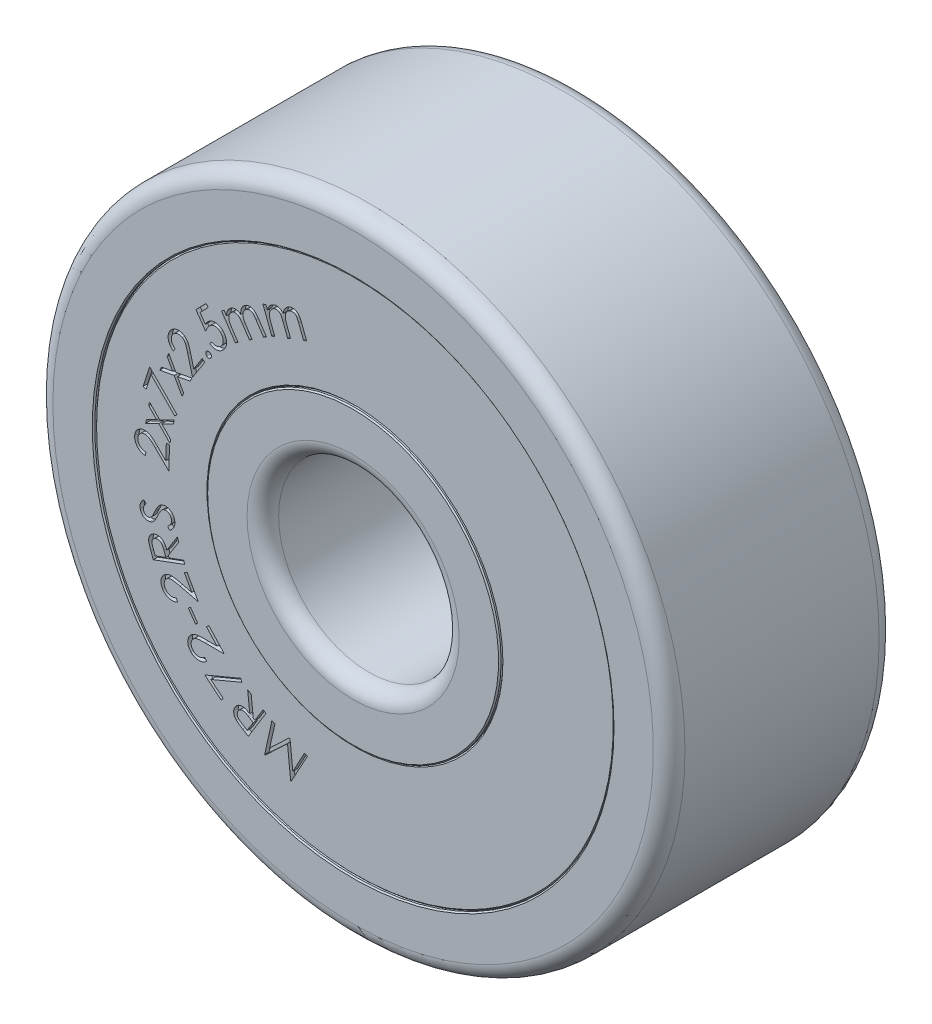
from build123d import *

# Parameters (mm, degrees)
SKETCH_R_INNER_BODY_W          = 2.5
SKETCH_R_INNER_BODY_H          = 0.625
FILLET_INNER_BODY_R            = 0.175
CHAMFER_INNER_BODY_SIZE        = 0.014
SKETCH_R_OUTER_BODY_W          = 2.5
SKETCH_R_OUTER_BODY_H          = 0.625
FILLET_OUTER_BODY_R            = 0.175
CHAMFER_OUTER_BODY_SIZE        = 0.014
SKETCH_R_SEAL_FACES_W          = 2.46
SKETCH_R_SEAL_FACES_H          = 1.25
CHAMFER_SEALS_SIZE             = 0.014
CUT_EXTRUDE_SEAL_LABEL_1_DEPTH = 0.05
CUT_EXTRUDE_SEAL_LABEL_2_DEPTH = 0.05


with BuildPart() as part:
    # Sketch R, INNER BODY → Revolve INNER BODY (revolve)
    with BuildSketch(Plane(origin=(0, 0, 0), x_dir=(0, 0, -1), z_dir=(1, 0, 0)), mode=Mode.PRIVATE) as revolve_inner_body_sk:
        with Locations((0, 1.3125)):
            Rectangle(SKETCH_R_INNER_BODY_W, SKETCH_R_INNER_BODY_H)
    revolve(revolve_inner_body_sk.sketch.rotate(Axis((0, 0, 17.5), (0, 0, -1)), 90), axis=Axis((0, 0, 17.5), (0, 0, -1)))

    # Fillet INNER BODY
    fillet_inner_body_edges = [part.edges().sort_by_distance(p)[0] for p in [
        (-1, 0, -1.25),
        (-1, 0, 1.25),
    ]]
    fillet(fillet_inner_body_edges, radius=FILLET_INNER_BODY_R)

    # Chamfer INNER BODY
    chamfer_inner_body_edges = [part.edges().sort_by_distance(p)[0] for p in [
        (-1.625, 0, 1.25),
        (-1.625, 0, -1.25),
    ]]
    chamfer(chamfer_inner_body_edges, length=CHAMFER_INNER_BODY_SIZE)


with BuildPart() as body_2:
    # Sketch R, OUTER BODY → Revolve OUTER BODY (revolve)
    with BuildSketch(Plane(origin=(0, 0, 0), x_dir=(0, 0, -1), z_dir=(1, 0, 0)), mode=Mode.PRIVATE) as revolve_outer_body_sk:
        with Locations((0, 3.1875)):
            Rectangle(SKETCH_R_OUTER_BODY_W, SKETCH_R_OUTER_BODY_H)
    revolve(revolve_outer_body_sk.sketch.rotate(Axis((0, 0, 17.5), (0, 0, -1)), 90), axis=Axis((0, 0, 17.5), (0, 0, -1)))

    # Fillet OUTER BODY
    fillet_outer_body_edges = [body_2.edges().sort_by_distance(p)[0] for p in [
        (-3.5, 0, 1.25),
        (-3.5, 0, -1.25),
    ]]
    fillet(fillet_outer_body_edges, radius=FILLET_OUTER_BODY_R)

    # Chamfer OUTER BODY
    chamfer_outer_body_edges = [body_2.edges().sort_by_distance(p)[0] for p in [
        (-2.875, 0, -1.25),
        (-2.875, 0, 1.25),
    ]]
    chamfer(chamfer_outer_body_edges, length=CHAMFER_OUTER_BODY_SIZE)


with BuildPart() as body_3:
    # Sketch R, SEAL FACES → Revolve SEALS (revolve)
    with BuildSketch(Plane(origin=(0, 0, 0), x_dir=(0, 0, -1), z_dir=(1, 0, 0)), mode=Mode.PRIVATE) as revolve_seals_sk:
        with Locations((0, 2.25)):
            Rectangle(SKETCH_R_SEAL_FACES_W, SKETCH_R_SEAL_FACES_H)
    revolve(revolve_seals_sk.sketch.rotate(Axis((0, 0, 17.5), (0, 0, -1)), 270), axis=Axis((0, 0, 17.5), (0, 0, -1)))

    # Chamfer SEALS
    chamfer_seals_edges = [body_3.edges().sort_by_distance(p)[0] for p in [
        (1.625, 0, -1.23),
        (1.625, 0, 1.23),
        (2.875, 0, 1.23),
        (2.875, 0, -1.23),
    ]]
    chamfer(chamfer_seals_edges, length=CHAMFER_SEALS_SIZE)

    # Sketch TEXT RADIUS 1 — MANUALLY ASSIGN TEXT AND FONT SIZE (FROM EQUATIONS) → Cut-Extrude SEAL LABEL 1 (cut)
    # profile 1 of 17: a face of its own
    with BuildSketch(Plane.XY.offset(1.23)):
        with BuildLine():
            Line((-1.01903656, 2.098933917), (-0.986058796, 2.111478989))
            Line((-0.986058796, 2.111478989), (-0.969006512, 2.066932715))
            add(Edge.make_bspline(
                [(-0.969006512, 2.066932715), (-0.967631117, 2.071889891), (-0.964994445, 2.081392937), (-0.959981575, 2.094677884), (-0.954183093, 2.106378755), (-0.949477325, 2.11322862), (-0.947221656, 2.116512042)],
                knots=[0, 0, 0, 0, 1.132654665, 2.171331037, 3.123443833, 4, 4, 4, 4], degree=3))
            add(Edge.make_bspline(
                [(-0.947221656, 2.116512042), (-0.943919008, 2.120442714), (-0.937413947, 2.128184763), (-0.925998542, 2.137943047), (-0.913670806, 2.146159442), (-0.904649695, 2.149977215), (-0.900121296, 2.151893653)],
                knots=[0, 0, 0, 0, 1.031768913, 2.032224069, 3.012219695, 4, 4, 4, 4], degree=3))
            add(Edge.make_bspline(
                [(-0.900121296, 2.151893653), (-0.896985419, 2.152984095), (-0.890771717, 2.155144793), (-0.881174067, 2.157245121), (-0.871479305, 2.158290318), (-0.861787802, 2.158374025), (-0.852304227, 2.157467333), (-0.843233942, 2.155726868), (-0.834756415, 2.152857268), (-0.826593655, 2.149251135), (-0.818703616, 2.144267038), (-0.810814986, 2.137956908), (-0.802729129, 2.130253047), (-0.797631125, 2.124347129), (-0.794953026, 2.121244614)],
                knots=[0, 0, 0, 0, 1.011399843, 2.004077054, 2.986933274, 3.979258264, 4.952972544, 5.887077429, 6.787420693, 7.675613107, 8.601227804, 9.622858686, 10.751233179, 12, 12, 12, 12], degree=3))
            add(Edge.make_bspline(
                [(-0.794953026, 2.121244614), (-0.794481754, 2.124254648), (-0.793554586, 2.130176508), (-0.79167809, 2.138836377), (-0.789353721, 2.147117944), (-0.786562613, 2.155045342), (-0.783330065, 2.162612596), (-0.779734265, 2.169860826), (-0.775670165, 2.176719573), (-0.769665306, 2.185269209), (-0.761390845, 2.195123725), (-0.74987972, 2.205054407), (-0.737352468, 2.213511499), (-0.728097927, 2.217395921), (-0.723438603, 2.219351585)],
                knots=[0, 0, 0, 0, 0.85891842, 1.689813036, 2.496693636, 3.282701343, 4.057724327, 4.815511584, 5.56259982, 6.30295211, 7.760260092, 9.176279106, 10.57835975, 12, 12, 12, 12], degree=3))
            add(Edge.make_bspline(
                [(-0.723438603, 2.219351585), (-0.71904313, 2.220865702), (-0.710444804, 2.223827583), (-0.697097739, 2.225884885), (-0.683939986, 2.226073587), (-0.670991909, 2.224252712), (-0.65854665, 2.220515958), (-0.646786486, 2.214862818), (-0.635875262, 2.207330268), (-0.627547231, 2.199517125), (-0.621217352, 2.192218953), (-0.616490684, 2.185745219), (-0.611694574, 2.178495267), (-0.606955379, 2.170344144), (-0.60232092, 2.161293883), (-0.597669525, 2.151368327), (-0.593025566, 2.140564051), (-0.59005476, 2.133021745), (-0.588522738, 2.129132234)],
                knots=[0, 0, 0, 0, 1.205724069, 2.358609974, 3.490585951, 4.613874283, 5.741655522, 6.853108772, 7.989878394, 9.172766155, 9.809210776, 10.497469819, 11.253443314, 12.066798872, 12.945455737, 13.894141975, 14.91402465, 16, 16, 16, 16], degree=3))
            Line((-0.588522738, 2.129132234), (-0.53473668, 1.988281874))
            Line((-0.53473668, 1.988281874), (-0.568615887, 1.975361201))
            Line((-0.568615887, 1.975361201), (-0.622401945, 2.116211561))
            add(Edge.make_bspline(
                [(-0.622401945, 2.116211561), (-0.623696045, 2.11951991), (-0.626184369, 2.125881274), (-0.629881511, 2.134959487), (-0.633601226, 2.143099085), (-0.637131582, 2.150387274), (-0.640436411, 2.156860668), (-0.643789425, 2.162362763), (-0.646895084, 2.167042444), (-0.650886154, 2.17205656), (-0.656238542, 2.177201513), (-0.663417932, 2.182170717), (-0.671362301, 2.185937031), (-0.679974894, 2.188479237), (-0.689065515, 2.189804132), (-0.698514924, 2.189502849), (-0.708215827, 2.187872338), (-0.714549934, 2.185691511), (-0.717804589, 2.184570936)],
                knots=[0, 0, 0, 0, 1.261096519, 2.424863664, 3.479051215, 4.437157526, 5.299930469, 6.057575578, 6.723234899, 7.292402202, 8.329664836, 9.345530379, 10.379283067, 11.436725965, 12.522846235, 13.625392355, 14.779854803, 16, 16, 16, 16], degree=3))
            add(Edge.make_bspline(
                [(-0.717804589, 2.184570936), (-0.721702316, 2.18289384), (-0.729416843, 2.17957447), (-0.739807061, 2.17238323), (-0.749083832, 2.163777528), (-0.756908083, 2.1536048), (-0.763304575, 2.142393483), (-0.767911971, 2.130298899), (-0.770812405, 2.117559996), (-0.771620558, 2.106379898), (-0.771225489, 2.096804339), (-0.77017254, 2.088685803), (-0.768626726, 2.079643177), (-0.766217842, 2.069770651), (-0.763320755, 2.058973376), (-0.759563007, 2.047362488), (-0.755316216, 2.034793556), (-0.752085237, 2.026183342), (-0.750406752, 2.021710359)],
                knots=[0, 0, 0, 0, 1.079869457, 2.137318094, 3.203638648, 4.295844077, 5.396882126, 6.484447495, 7.584429374, 8.71782853, 9.331434101, 10.026120551, 10.804108694, 11.670019607, 12.616597645, 13.654740481, 14.781644046, 16, 16, 16, 16], degree=3))
            Line((-0.750406752, 2.021710359), (-0.711794974, 1.920673701))
            Line((-0.711794974, 1.920673701), (-0.744772738, 1.908053508))
            Line((-0.744772738, 1.908053508), (-0.795253507, 2.040114806))
            add(Edge.make_bspline(
                [(-0.795253507, 2.040114806), (-0.796686177, 2.043853628), (-0.799428433, 2.05101006), (-0.803672454, 2.061153057), (-0.80762687, 2.070342466), (-0.811431314, 2.078523652), (-0.815113747, 2.085692348), (-0.818620555, 2.091834979), (-0.821913167, 2.097008299), (-0.826057091, 2.102463078), (-0.831557851, 2.108064146), (-0.838836382, 2.113587875), (-0.846982866, 2.117739683), (-0.855784457, 2.120582625), (-0.865028749, 2.122077084), (-0.874592341, 2.12219658), (-0.884344767, 2.120558718), (-0.89070619, 2.118428456), (-0.89396144, 2.117338364)],
                knots=[0, 0, 0, 0, 1.336136636, 2.557482775, 3.669032031, 4.674671351, 5.567925585, 6.357742882, 7.034573339, 7.612869611, 8.641101127, 9.643889339, 10.649250857, 11.677244644, 12.718601831, 13.76320631, 14.855394139, 16, 16, 16, 16], degree=3))
            add(Edge.make_bspline(
                [(-0.89396144, 2.117338364), (-0.897680199, 2.115729685), (-0.905078074, 2.112529474), (-0.915112394, 2.105568294), (-0.924114803, 2.097079683), (-0.931941299, 2.087119776), (-0.938388718, 2.076054636), (-0.943187837, 2.064112684), (-0.946194172, 2.051460879), (-0.947220728, 2.04035905), (-0.946984411, 2.030962163), (-0.946316366, 2.023150919), (-0.944926931, 2.014703773), (-0.942924963, 2.005597329), (-0.940480093, 1.995800692), (-0.937262875, 1.98540994), (-0.933604507, 1.974287375), (-0.930750116, 1.966736853), (-0.92926793, 1.962816129)],
                knots=[0, 0, 0, 0, 1.085077313, 2.158587668, 3.256652952, 4.395272715, 5.545452367, 6.682167154, 7.836050467, 9.023545407, 9.662031874, 10.356769344, 11.125636755, 11.957244885, 12.858474347, 13.834179666, 14.875364779, 16, 16, 16, 16], degree=3))
            Line((-0.92926793, 1.962816129), (-0.887501103, 1.853516249))
            Line((-0.887501103, 1.853516249), (-0.920478868, 1.840971177))
            Line((-0.920478868, 1.840971177), (-1.01903656, 2.098933917))
        make_face()
    # profile 2 of 17: a face of its own
    with BuildSketch(Plane.XY.offset(1.23)):
        with BuildLine():
            Line((-1.478153826, 1.805024723), (-1.448781831, 1.824706214))
            Line((-1.448781831, 1.824706214), (-1.422189282, 1.784967632))
            add(Edge.make_bspline(
                [(-1.422189282, 1.784967632), (-1.421985376, 1.790134637), (-1.421594768, 1.800032698), (-1.419504976, 1.814122456), (-1.416603589, 1.826886457), (-1.413473272, 1.834604009), (-1.411972936, 1.838302969)],
                knots=[0, 0, 0, 0, 1.134729945, 2.173720573, 3.12467913, 4, 4, 4, 4], degree=3))
            add(Edge.make_bspline(
                [(-1.411972936, 1.838302969), (-1.409644412, 1.842885533), (-1.405063873, 1.851900086), (-1.396105216, 1.863980564), (-1.385877247, 1.874712531), (-1.377939516, 1.880483431), (-1.373962119, 1.883375084)],
                knots=[0, 0, 0, 0, 1.032008918, 2.030107901, 3.012936566, 4, 4, 4, 4], degree=3))
            add(Edge.make_bspline(
                [(-1.373962119, 1.883375084), (-1.371169713, 1.885145064), (-1.365620772, 1.888662287), (-1.356676115, 1.892725584), (-1.347483337, 1.896059659), (-1.337977011, 1.898131876), (-1.328508218, 1.899474673), (-1.319234263, 1.89968989), (-1.310290861, 1.898947234), (-1.301521547, 1.897205889), (-1.292681143, 1.89418438), (-1.283581786, 1.889701519), (-1.273931101, 1.884023675), (-1.267649307, 1.87935702), (-1.264361758, 1.876914747)],
                knots=[0, 0, 0, 0, 1.004495505, 1.996086991, 2.981339738, 3.97354533, 4.949480288, 5.886599842, 6.788579411, 7.674366582, 8.599273151, 9.62128825, 10.755112202, 12, 12, 12, 12], degree=3))
            add(Edge.make_bspline(
                [(-1.264361758, 1.876914747), (-1.264598791, 1.879942733), (-1.265066484, 1.885917302), (-1.265123962, 1.894774543), (-1.264681214, 1.903404279), (-1.263711181, 1.911758042), (-1.262249517, 1.919877035), (-1.260443821, 1.927766303), (-1.257896962, 1.935364331), (-1.254057902, 1.945115738), (-1.248062494, 1.956527213), (-1.23920132, 1.968893357), (-1.228760179, 1.979840567), (-1.220663203, 1.985778292), (-1.216585316, 1.988768714)],
                knots=[0, 0, 0, 0, 0.854887766, 1.686793637, 2.491582807, 3.286461052, 4.052589407, 4.813510372, 5.562582364, 6.306160476, 7.763014207, 9.177513339, 10.578508548, 12, 12, 12, 12], degree=3))
            add(Edge.make_bspline(
                [(-1.216585316, 1.988768714), (-1.21261751, 1.991217791), (-1.20484933, 1.9960126), (-1.192265857, 2.001062103), (-1.179415776, 2.004212947), (-1.166333955, 2.005237467), (-1.153316328, 2.004353805), (-1.140564996, 2.001475216), (-1.128220676, 1.996556609), (-1.118322784, 1.990851536), (-1.110517332, 1.985106382), (-1.104433301, 1.979893214), (-1.098185684, 1.973828062), (-1.091714505, 1.966952782), (-1.08525948, 1.95904935), (-1.078349169, 1.950547651), (-1.071467566, 1.941011789), (-1.066904731, 1.934317447), (-1.064542047, 1.930851046)],
                knots=[0, 0, 0, 0, 1.206719873, 2.362518798, 3.497484184, 4.62395593, 5.749455031, 6.867349765, 7.997834139, 9.181202474, 9.817273275, 10.507860199, 11.25603474, 12.073385304, 12.9533973, 13.900096418, 14.91264778, 16, 16, 16, 16], degree=3))
            Line((-1.064542047, 1.930851046), (-0.980482552, 1.805325204))
            Line((-0.980482552, 1.805325204), (-1.010680869, 1.785117872))
            Line((-1.010680869, 1.785117872), (-1.094740364, 1.910643714))
            add(Edge.make_bspline(
                [(-1.094740364, 1.910643714), (-1.096735151, 1.913579051), (-1.100577066, 1.919232446), (-1.106231209, 1.927264165), (-1.111673501, 1.934384728), (-1.116676524, 1.940766106), (-1.121489556, 1.946211052), (-1.125881181, 1.950892031), (-1.129982204, 1.954726993), (-1.135004451, 1.958683329), (-1.141411574, 1.962511794), (-1.149514267, 1.965798359), (-1.15812621, 1.967662212), (-1.167084363, 1.968254329), (-1.176268487, 1.967531886), (-1.185442254, 1.965227142), (-1.194510083, 1.961401976), (-1.20020222, 1.95789875), (-1.203138802, 1.95609143)],
                knots=[0, 0, 0, 0, 1.258927972, 2.424667007, 3.483441527, 4.437815732, 5.300123708, 6.060319635, 6.713993395, 7.289695828, 8.325532251, 9.349803278, 10.377764829, 11.437135296, 12.524400792, 13.631690349, 14.77818559, 16, 16, 16, 16], degree=3))
            add(Edge.make_bspline(
                [(-1.203138802, 1.95609143), (-1.206556749, 1.953564295), (-1.213342639, 1.948546995), (-1.221936562, 1.93924385), (-1.229050438, 1.928714291), (-1.23443568, 1.917052855), (-1.238247103, 1.904676893), (-1.24003332, 1.891850129), (-1.239962124, 1.878766212), (-1.238233518, 1.867681478), (-1.235757671, 1.85838503), (-1.232898819, 1.850663118), (-1.229314546, 1.842165306), (-1.224740571, 1.83304567), (-1.219484495, 1.823145425), (-1.21330012, 1.81259928), (-1.206306022, 1.801289931), (-1.201208412, 1.793616864), (-1.19855647, 1.789625084)],
                knots=[0, 0, 0, 0, 1.079217788, 2.142647112, 3.202504056, 4.299447971, 5.397500657, 6.484638626, 7.580102433, 8.714136564, 9.327468802, 10.024503506, 10.806423101, 11.672308122, 12.618272634, 13.657101188, 14.781147749, 16, 16, 16, 16], degree=3))
            Line((-1.19855647, 1.789625084), (-1.138310076, 1.699631094))
            Line((-1.138310076, 1.699631094), (-1.167682071, 1.679949603))
            Line((-1.167682071, 1.679949603), (-1.246483153, 1.797662945))
            add(Edge.make_bspline(
                [(-1.246483153, 1.797662945), (-1.248723767, 1.800977193), (-1.25302677, 1.807342066), (-1.25940117, 1.81632397), (-1.265340948, 1.824423221), (-1.270914383, 1.831526858), (-1.276172334, 1.837627005), (-1.28083635, 1.842953798), (-1.285255561, 1.847223116), (-1.290533415, 1.851639224), (-1.297141439, 1.855907662), (-1.305520474, 1.859555689), (-1.314364167, 1.861864087), (-1.323597467, 1.86264095), (-1.332984548, 1.862083158), (-1.342295409, 1.859890637), (-1.351510805, 1.856300355), (-1.357211196, 1.852748216), (-1.360140004, 1.850923161)],
                knots=[0, 0, 0, 0, 1.333051103, 2.560067846, 3.669846448, 4.679776378, 5.567614944, 6.353410843, 7.037921104, 7.612686401, 8.644946399, 9.646361156, 10.646105959, 11.676509524, 12.721638917, 13.766068614, 14.852227144, 16, 16, 16, 16], degree=3))
            add(Edge.make_bspline(
                [(-1.360140004, 1.850923161), (-1.363403922, 1.848517368), (-1.369925195, 1.84371062), (-1.378237998, 1.8346963), (-1.385111379, 1.824348885), (-1.390548048, 1.812916369), (-1.394414749, 1.800687183), (-1.396340929, 1.787970486), (-1.396520136, 1.774942044), (-1.394980781, 1.763900294), (-1.392701287, 1.754736079), (-1.39017691, 1.747328089), (-1.387004049, 1.739362715), (-1.383003046, 1.730942641), (-1.378312967, 1.721989204), (-1.37298733, 1.712482509), (-1.366796653, 1.702533213), (-1.362357922, 1.695765499), (-1.360064883, 1.692269315)],
                knots=[0, 0, 0, 0, 1.084556013, 2.166930676, 3.264852838, 4.402267605, 5.548199498, 6.688815641, 7.836219761, 9.028021566, 9.664293679, 10.364465345, 11.123233133, 11.960659136, 12.860958939, 13.831335484, 14.879673096, 16, 16, 16, 16], degree=3))
            Line((-1.360064883, 1.692269315), (-1.294860557, 1.594838425))
            Line((-1.294860557, 1.594838425), (-1.324232552, 1.575156935))
            Line((-1.324232552, 1.575156935), (-1.478153826, 1.805024723))
        make_face()
    # profile 3 of 17: a face of its own
    with BuildSketch(Plane.XY.offset(1.23)):
        with BuildLine():
            Line((-1.648769365, 1.79017357), (-1.62345386, 1.765459027))
            Line((-1.62345386, 1.765459027), (-1.715851696, 1.670732464))
            Line((-1.715851696, 1.670732464), (-1.656206264, 1.586898329))
            add(Edge.make_bspline(
                [(-1.656206264, 1.586898329), (-1.654257993, 1.590462333), (-1.650479804, 1.597373838), (-1.644084153, 1.606877507), (-1.637738846, 1.61554022), (-1.633018109, 1.620593237), (-1.630740518, 1.623031142)],
                knots=[0, 0, 0, 0, 1.098511281, 2.130291335, 3.097930614, 4, 4, 4, 4], degree=3))
            add(Edge.make_bspline(
                [(-1.630740518, 1.623031142), (-1.627787252, 1.625917991), (-1.621962954, 1.631611303), (-1.612488454, 1.639019745), (-1.602644701, 1.645339809), (-1.592424904, 1.650469229), (-1.58180122, 1.654373527), (-1.570873256, 1.657289602), (-1.55952906, 1.658907648), (-1.547931563, 1.659424526), (-1.536307243, 1.658836514), (-1.524845755, 1.657116252), (-1.513701383, 1.654157655), (-1.502834171, 1.650075423), (-1.4922459, 1.644872439), (-1.482027814, 1.638417173), (-1.472021268, 1.630907808), (-1.465848281, 1.625096617), (-1.462696648, 1.6221297)],
                knots=[0, 0, 0, 0, 1.051566048, 2.073850768, 3.057834281, 4.027883218, 4.980659871, 5.936954246, 6.904145889, 7.894006075, 8.890545861, 9.864990337, 10.841416772, 11.822562832, 12.818305884, 13.84146612, 14.897955483, 16, 16, 16, 16], degree=3))
            add(Edge.make_bspline(
                [(-1.462696648, 1.6221297), (-1.46056471, 1.619977814), (-1.456344725, 1.615718345), (-1.450549171, 1.608896221), (-1.445228524, 1.601892167), (-1.440455856, 1.594600957), (-1.436171571, 1.587072434), (-1.432336638, 1.579314426), (-1.429100684, 1.571261963), (-1.425444199, 1.560402911), (-1.422125718, 1.546650856), (-1.420650535, 1.530034145), (-1.421330551, 1.513558464), (-1.424059489, 1.500085354), (-1.427197628, 1.489508456), (-1.430271555, 1.481734733), (-1.433762391, 1.474085946), (-1.437875578, 1.466595098), (-1.442493726, 1.459233136), (-1.447833562, 1.452105024), (-1.453554031, 1.445021938), (-1.457782751, 1.440561832), (-1.459917201, 1.438310589)],
                knots=[0, 0, 0, 0, 0.882005519, 1.745852306, 2.605006589, 3.442465353, 4.28195417, 5.126748665, 5.961025584, 6.807455572, 8.463288966, 10.067165751, 11.651488842, 13.24918509, 14.056733563, 14.862600637, 15.681692408, 16.504154141, 17.349924022, 18.210562913, 19.096779941, 20, 20, 20, 20], degree=3))
            add(Edge.make_bspline(
                [(-1.459917201, 1.438310589), (-1.462547133, 1.435701406), (-1.467722105, 1.43056726), (-1.476205321, 1.423934857), (-1.484873138, 1.418051161), (-1.493904916, 1.41320118), (-1.50319845, 1.409133464), (-1.512860391, 1.406159059), (-1.522816116, 1.40403816), (-1.533001533, 1.402862972), (-1.543234457, 1.402529488), (-1.553368108, 1.403230646), (-1.563324096, 1.404810453), (-1.573109581, 1.407288484), (-1.582703536, 1.410709187), (-1.592126471, 1.414987332), (-1.601334587, 1.420279982), (-1.60718464, 1.424415225), (-1.610157586, 1.426516719)],
                knots=[0, 0, 0, 0, 1.07368155, 2.112706154, 3.117899717, 4.109115247, 5.081878076, 6.055887377, 7.035943801, 8.030533037, 9.025997032, 10.001440512, 10.972221958, 11.94636665, 12.924968703, 13.922788078, 14.944378963, 16, 16, 16, 16], degree=3))
            Line((-1.610157586, 1.426516719), (-1.583565038, 1.453785349))
            add(Edge.make_bspline(
                [(-1.583565038, 1.453785349), (-1.58056998, 1.451945099), (-1.574776211, 1.44838524), (-1.565831927, 1.444249912), (-1.557092937, 1.441325514), (-1.548507218, 1.4396058), (-1.539942461, 1.439219173), (-1.531312171, 1.439701753), (-1.522569699, 1.441409805), (-1.513819025, 1.444127411), (-1.505257403, 1.447712395), (-1.497251879, 1.452393599), (-1.489738797, 1.45773993), (-1.485332591, 1.462014505), (-1.483129341, 1.464151935)],
                knots=[0, 0, 0, 0, 1.147879037, 2.220506506, 3.211479376, 4.153409335, 5.071111658, 6.005620797, 6.971655878, 7.973245658, 8.99603318, 9.996686769, 10.99827655, 12, 12, 12, 12], degree=3))
            add(Edge.make_bspline(
                [(-1.483129341, 1.464151935), (-1.481077642, 1.466364569), (-1.477049193, 1.470709011), (-1.471893446, 1.477873048), (-1.467603179, 1.48540845), (-1.464125022, 1.493305594), (-1.461551401, 1.501600104), (-1.459848613, 1.510237643), (-1.458918696, 1.51926731), (-1.458969543, 1.528547661), (-1.459750121, 1.537908321), (-1.461491714, 1.547062303), (-1.464059933, 1.555949814), (-1.46752252, 1.564538894), (-1.471934266, 1.572848358), (-1.477180151, 1.580896236), (-1.483401471, 1.588595036), (-1.488049031, 1.593393705), (-1.490415999, 1.595837632)],
                knots=[0, 0, 0, 0, 0.985220275, 1.93445118, 2.876212588, 3.81412773, 4.748324093, 5.707865785, 6.68643888, 7.709165011, 8.735843501, 9.751607763, 10.748479861, 11.754276806, 12.771720209, 13.817872562, 14.888658519, 16, 16, 16, 16], degree=3))
            add(Edge.make_bspline(
                [(-1.490415999, 1.595837632), (-1.492658756, 1.597932249), (-1.497058323, 1.602041212), (-1.504129573, 1.60737608), (-1.511419011, 1.611835768), (-1.518849677, 1.615581252), (-1.526556143, 1.618332002), (-1.534421781, 1.62035246), (-1.542519968, 1.621339133), (-1.55074508, 1.62169413), (-1.558976662, 1.621061578), (-1.567096633, 1.619657461), (-1.575008159, 1.61727326), (-1.582825512, 1.614137342), (-1.590365851, 1.609945839), (-1.597801207, 1.605032565), (-1.605045271, 1.599249581), (-1.609521705, 1.594804725), (-1.61181023, 1.592532344)],
                knots=[0, 0, 0, 0, 1.076170024, 2.111099331, 3.101049766, 4.071511468, 5.024760698, 5.966565064, 6.914618109, 7.881653845, 8.850603242, 9.805349226, 10.76718301, 11.744421126, 12.754783466, 13.787921332, 14.869100153, 16, 16, 16, 16], degree=3))
            add(Edge.make_bspline(
                [(-1.61181023, 1.592532344), (-1.61371415, 1.590476838), (-1.617640833, 1.586237522), (-1.623186659, 1.579250443), (-1.628500392, 1.571446227), (-1.633769174, 1.562966329), (-1.63886794, 1.553706751), (-1.643794514, 1.543716188), (-1.648651709, 1.53301078), (-1.65160616, 1.52553868), (-1.653126336, 1.521694003)],
                knots=[0, 0, 0, 0, 0.814606592, 1.680060758, 2.591036926, 3.558993403, 4.582442804, 5.663639964, 6.797854589, 8, 8, 8, 8], degree=3))
            Line((-1.653126336, 1.521694003), (-1.761149172, 1.675014315))
            Line((-1.761149172, 1.675014315), (-1.648769365, 1.79017357))
        make_face()
    # profile 4 of 17: a face of its own
    with BuildSketch(Plane.XY.offset(1.23)):
        with BuildLine():
            add(Edge.make_bspline(
                [(-1.644997419, 1.332636093), (-1.643607834, 1.334207361), (-1.640888099, 1.33728269), (-1.635776636, 1.340675631), (-1.63018879, 1.343091732), (-1.624117207, 1.344236076), (-1.61791365, 1.344312498), (-1.611829262, 1.343318632), (-1.606081889, 1.340886631), (-1.602712012, 1.338465154), (-1.600976987, 1.337218425)],
                knots=[0, 0, 0, 0, 1.019545707, 1.995482501, 2.964435346, 3.973163091, 4.987277445, 5.979519529, 6.959729405, 8, 8, 8, 8], degree=3))
            add(Edge.make_bspline(
                [(-1.600976987, 1.337218425), (-1.599406798, 1.335828416), (-1.596333582, 1.333107852), (-1.592912413, 1.327983004), (-1.590539816, 1.322320618), (-1.58931102, 1.316223102), (-1.589116893, 1.310004785), (-1.590184805, 1.303972763), (-1.592452261, 1.29825734), (-1.594864996, 1.294955333), (-1.596094174, 1.293273113)],
                knots=[0, 0, 0, 0, 1.021835233, 1.999963622, 2.98237469, 4.007798532, 5.024411467, 6.006822534, 6.984567629, 8, 8, 8, 8], degree=3))
            add(Edge.make_bspline(
                [(-1.596094174, 1.293273113), (-1.597486668, 1.29170633), (-1.60019834, 1.288655255), (-1.605265487, 1.285191848), (-1.610910061, 1.282821852), (-1.617022274, 1.281685154), (-1.623239434, 1.281562256), (-1.6292745, 1.282705186), (-1.634963956, 1.285060993), (-1.638279297, 1.287467593), (-1.639964366, 1.288690781)],
                knots=[0, 0, 0, 0, 1.022583333, 1.991328027, 2.974458332, 3.998215698, 5.015351496, 6.000693913, 6.983824217, 8, 8, 8, 8], degree=3))
            add(Edge.make_bspline(
                [(-1.639964366, 1.288690781), (-1.641556489, 1.290108065), (-1.644657891, 1.292868887), (-1.648176458, 1.297993622), (-1.650622762, 1.303625647), (-1.651885773, 1.309710214), (-1.651947672, 1.315905244), (-1.650913824, 1.321936345), (-1.648637498, 1.327651892), (-1.646225978, 1.330953882), (-1.644997419, 1.332636093)],
                knots=[0, 0, 0, 0, 1.036965179, 2.019972763, 3.00510446, 4.016411197, 5.030666356, 6.011012329, 6.986702137, 8, 8, 8, 8], degree=3))
        make_face()
    # profile 5 of 17: a face of its own
    with BuildSketch(Plane.XY.offset(1.23)):
        with BuildLine():
            Line((-1.990254777, 1.183473648), (-2.009635786, 1.153350451))
            add(Edge.make_bspline(
                [(-2.009635786, 1.153350451), (-2.013318923, 1.155962388), (-2.020549486, 1.161090021), (-2.030341473, 1.169819049), (-2.039067579, 1.179041188), (-2.046734315, 1.188810014), (-2.053321524, 1.199130477), (-2.058715609, 1.210085886), (-2.06312011, 1.221540477), (-2.06629458, 1.233458036), (-2.068442229, 1.245546096), (-2.069222572, 1.257605296), (-2.068983061, 1.269511938), (-2.067374238, 1.28124347), (-2.064570315, 1.292817575), (-2.060566499, 1.304226155), (-2.055283773, 1.315452263), (-2.050965831, 1.322631761), (-2.048773406, 1.326277133)],
                knots=[0, 0, 0, 0, 1.096569677, 2.15273491, 3.181550265, 4.178505768, 5.16605723, 6.151187275, 7.141172931, 8.143462559, 9.14386627, 10.119781879, 11.07545396, 12.033293365, 12.991152099, 13.964959629, 14.966713426, 16, 16, 16, 16], degree=3))
            add(Edge.make_bspline(
                [(-2.048773406, 1.326277133), (-2.04643513, 1.329756203), (-2.041845414, 1.336585139), (-2.033964254, 1.345821898), (-2.025635975, 1.354068611), (-2.016731147, 1.361190062), (-2.007246879, 1.36713656), (-1.997298532, 1.372168457), (-1.986727471, 1.376006513), (-1.975723264, 1.378620246), (-1.96462325, 1.380402217), (-1.953600279, 1.380961994), (-1.942809934, 1.38062649), (-1.932235637, 1.379194689), (-1.921908735, 1.376677268), (-1.911766722, 1.373233733), (-1.901896257, 1.368623249), (-1.895621542, 1.364846014), (-1.892448286, 1.362935787)],
                knots=[0, 0, 0, 0, 1.121369703, 2.201094312, 3.243920168, 4.255202201, 5.246423977, 6.235694572, 7.234480536, 8.248978806, 9.259594132, 10.239738419, 11.198890586, 12.145950184, 13.090563178, 14.040252351, 15.008914228, 16, 16, 16, 16], degree=3))
            add(Edge.make_bspline(
                [(-1.892448286, 1.362935787), (-1.888155308, 1.359965124), (-1.87963275, 1.354067669), (-1.868427591, 1.343330672), (-1.858592416, 1.331351806), (-1.851702023, 1.320121589), (-1.846646944, 1.310173894), (-1.842807165, 1.301575441), (-1.83905388, 1.291854305), (-1.834994609, 1.281137793), (-1.831180498, 1.269240373), (-1.827152096, 1.256314798), (-1.823214904, 1.242269201), (-1.820621999, 1.232530118), (-1.819281219, 1.22749408)],
                knots=[0, 0, 0, 0, 1.188154769, 2.358763135, 3.522718164, 4.711913924, 5.352482963, 6.065145572, 6.856714144, 7.726975343, 8.676163522, 9.70320746, 10.812338651, 12, 12, 12, 12], degree=3))
            Line((-1.819281219, 1.22749408), (-1.785101531, 1.095057181))
            Line((-1.785101531, 1.095057181), (-1.691952493, 1.240114273))
            Line((-1.691952493, 1.240114273), (-1.661603935, 1.220658143))
            Line((-1.661603935, 1.220658143), (-1.798698286, 1.007241677))
            Line((-1.798698286, 1.007241677), (-1.851207301, 1.210667157))
            add(Edge.make_bspline(
                [(-1.851207301, 1.210667157), (-1.852468861, 1.215604067), (-1.854894555, 1.225096622), (-1.858634579, 1.238700818), (-1.862353354, 1.251070904), (-1.865758157, 1.262296897), (-1.8691276, 1.272297282), (-1.872429833, 1.281083579), (-1.875564676, 1.28868566), (-1.879500655, 1.297153958), (-1.88495222, 1.306417541), (-1.892568491, 1.316292048), (-1.901445041, 1.324907244), (-1.908155638, 1.329618226), (-1.911528815, 1.331986268)],
                knots=[0, 0, 0, 0, 1.320536273, 2.539090982, 3.656042259, 4.667977492, 5.579117456, 6.390279709, 7.100109253, 7.709723456, 8.809310066, 9.877603054, 10.933146774, 12, 12, 12, 12], degree=3))
            add(Edge.make_bspline(
                [(-1.911528815, 1.331986268), (-1.913736, 1.333301573), (-1.918099761, 1.335902025), (-1.924966388, 1.339103996), (-1.932063814, 1.341406295), (-1.939304897, 1.343036626), (-1.946717655, 1.343725485), (-1.954265215, 1.343856931), (-1.961986263, 1.34304722), (-1.969773894, 1.341557539), (-1.977459862, 1.339424672), (-1.984805149, 1.336545557), (-1.991713482, 1.333005693), (-1.998264687, 1.328850858), (-2.004324354, 1.323950076), (-2.009997417, 1.318411528), (-2.015302538, 1.312258555), (-2.018369639, 1.30770581), (-2.019927253, 1.30539372)],
                knots=[0, 0, 0, 0, 0.993418784, 1.964058795, 2.922641906, 3.874351253, 4.828373743, 5.796885579, 6.789454279, 7.824623435, 8.860924542, 9.86984777, 10.870369381, 11.859008786, 12.864812945, 13.878419913, 14.922565409, 16, 16, 16, 16], degree=3))
            add(Edge.make_bspline(
                [(-2.019927253, 1.30539372), (-2.021453363, 1.302891422), (-2.024450259, 1.297977537), (-2.028042434, 1.290265465), (-2.030883425, 1.282513803), (-2.032738744, 1.274612797), (-2.033882298, 1.266670496), (-2.034215108, 1.258608658), (-2.03354291, 1.25048957), (-2.032250131, 1.242293713), (-2.029963573, 1.234197403), (-2.026888044, 1.22624992), (-2.022862171, 1.218570964), (-2.018003394, 1.211102929), (-2.012366184, 1.203779034), (-2.005783261, 1.196741241), (-1.998417432, 1.189867369), (-1.993017433, 1.185637607), (-1.990254777, 1.183473648)],
                knots=[0, 0, 0, 0, 1.006100711, 1.975728974, 2.917095644, 3.837118583, 4.757945316, 5.670337434, 6.601828388, 7.552073304, 8.516192271, 9.485744231, 10.474450711, 11.488425581, 12.543064845, 13.644743107, 14.795043148, 16, 16, 16, 16], degree=3))
        make_face()
    # profile 6 of 17: a face of its own
    with BuildSketch(Plane.XY.offset(1.23)):
        Polygon((-2.160617986, 0.895026671), (-2.142288659, 0.93371357), (-2.018114981, 0.955949147), (-2.079413058, 1.06622559), (-2.061083731, 1.104837368), (-1.98273337, 0.962785085), (-1.805599957, 0.996814532), (-1.824229765, 0.957676912), (-1.965681087, 0.931084364), (-1.896345149, 0.805633642), (-1.914599356, 0.767247224), (-2.000987577, 0.924323546), align=None)
    # profile 7 of 17: a face of its own
    with BuildSketch(Plane.XY.offset(1.23)):
        Polygon((-2.346406986, 0.645889749), (-2.273089678, 0.871475686), (-1.970355303, 0.562656576), (-1.994769366, 0.538317633), (-2.257389558, 0.805369917), (-2.31275314, 0.634922201), align=None)
    # profile 8 of 17: a face of its own
    with BuildSketch(Plane.XY.offset(1.23)):
        Polygon((-2.316698459, 0.306870788), (-2.308961079, 0.348712735), (-2.195529589, 0.401972952), (-2.282669012, 0.492042062), (-2.275006752, 0.533808889), (-2.163303027, 0.417597952), (-2.002095094, 0.495798072), (-2.009907594, 0.453505403), (-2.138813844, 0.391531245), (-2.040105911, 0.288992182), (-2.047693051, 0.247450716), (-2.170965286, 0.376056485), align=None)
    # profile 9 of 17: a face of its own
    with BuildSketch(Plane.XY.offset(1.23)):
        with BuildLine():
            Line((-2.316124836, 0.030687387), (-2.31740188, -0.005069825))
            add(Edge.make_bspline(
                [(-2.31740188, -0.005069825), (-2.321895294, -0.004706832), (-2.330738564, -0.003992443), (-2.343595277, -0.001434035), (-2.35581508, 0.002002854), (-2.367422091, 0.00643034), (-2.378313137, 0.012029319), (-2.388606978, 0.018579315), (-2.398189957, 0.026217505), (-2.40699787, 0.034821217), (-2.414930412, 0.044187197), (-2.421893299, 0.054084185), (-2.427596739, 0.06454911), (-2.432349077, 0.075400151), (-2.43574328, 0.086820331), (-2.438201195, 0.098648836), (-2.439391411, 0.110990844), (-2.439345391, 0.119352318), (-2.439321952, 0.123611065)],
                knots=[0, 0, 0, 0, 1.095004478, 2.155025053, 3.18004237, 4.178141072, 5.168994054, 6.151662372, 7.139313398, 8.142207341, 9.139767689, 10.119093813, 11.078006309, 12.032271383, 12.993055833, 13.968306824, 14.965198466, 16, 16, 16, 16], degree=3))
            add(Edge.make_bspline(
                [(-2.439321952, 0.123611065), (-2.439070165, 0.12779993), (-2.438577686, 0.135993101), (-2.436604614, 0.147947091), (-2.433597734, 0.159237748), (-2.429628866, 0.169911136), (-2.424546005, 0.179904006), (-2.418442056, 0.189241539), (-2.411337996, 0.197926412), (-2.403313452, 0.20586138), (-2.394581904, 0.212909155), (-2.385467876, 0.219104486), (-2.376025059, 0.22437067), (-2.366184949, 0.228480854), (-2.356006374, 0.231568981), (-2.34555819, 0.233770688), (-2.334731299, 0.234940795), (-2.327420319, 0.23484005), (-2.323711976, 0.234788949)],
                knots=[0, 0, 0, 0, 1.123988703, 2.198454515, 3.240153191, 4.250919689, 5.244229009, 6.238082136, 7.234740207, 8.245395332, 9.256696251, 10.237506599, 11.195581805, 12.148945754, 13.089255984, 14.042053017, 15.006872016, 16, 16, 16, 16], degree=3))
            add(Edge.make_bspline(
                [(-2.323711976, 0.234788949), (-2.318513343, 0.234414092), (-2.308195598, 0.233670111), (-2.293031811, 0.230330706), (-2.278519762, 0.224886844), (-2.266793203, 0.218872892), (-2.257377322, 0.212894981), (-2.249713694, 0.207437458), (-2.241428681, 0.201119501), (-2.232600562, 0.193805408), (-2.223137594, 0.185638089), (-2.21315654, 0.176505334), (-2.202533312, 0.166518686), (-2.195365951, 0.159434609), (-2.191650678, 0.155762507)],
                knots=[0, 0, 0, 0, 1.186875186, 2.355595295, 3.523883353, 4.71077226, 5.35203013, 6.064574993, 6.85447011, 7.726240884, 8.677071764, 9.703243071, 10.809453154, 12, 12, 12, 12], degree=3))
            Line((-2.191650678, 0.155762507), (-2.09474563, 0.059533541))
            Line((-2.09474563, 0.059533541), (-2.088736014, 0.231709021))
            Line((-2.088736014, 0.231709021), (-2.052753442, 0.230431978))
            Line((-2.052753442, 0.230431978), (-2.061617625, -0.02287331))
            Line((-2.061617625, -0.02287331), (-2.210505846, 0.125038348))
            add(Edge.make_bspline(
                [(-2.210505846, 0.125038348), (-2.214100768, 0.128630027), (-2.221015614, 0.135538635), (-2.231149745, 0.145315275), (-2.240635131, 0.154082653), (-2.249293682, 0.161984189), (-2.257276472, 0.168859153), (-2.264583392, 0.174724855), (-2.271126358, 0.179703437), (-2.278902198, 0.184901749), (-2.288327664, 0.190045585), (-2.299916215, 0.194623595), (-2.311905832, 0.197567704), (-2.320065586, 0.198192286), (-2.324162697, 0.198505896)],
                knots=[0, 0, 0, 0, 1.318502765, 2.536144924, 3.65326653, 4.669810309, 5.577459533, 6.386144315, 7.100812082, 7.709867112, 8.811713496, 9.879454109, 10.935248294, 12, 12, 12, 12], degree=3))
            add(Edge.make_bspline(
                [(-2.324162697, 0.198505896), (-2.326743786, 0.198534898), (-2.331845782, 0.198592225), (-2.339376124, 0.197738014), (-2.346652704, 0.196157201), (-2.353677869, 0.193811407), (-2.360475158, 0.190712263), (-2.367001856, 0.186862448), (-2.373319114, 0.182319022), (-2.379231597, 0.1770094), (-2.384752654, 0.171241255), (-2.389606902, 0.165023264), (-2.39375821, 0.15845594), (-2.397229274, 0.151544217), (-2.399944841, 0.14425842), (-2.401967338, 0.136635345), (-2.40334845, 0.128639053), (-2.403690958, 0.12316568), (-2.403865221, 0.120380896)],
                knots=[0, 0, 0, 0, 0.997437442, 1.971618515, 2.923206809, 3.872476618, 4.830154825, 5.80669126, 6.798424838, 7.834186824, 8.875321454, 9.882581495, 10.87926658, 11.875292887, 12.868113193, 13.88048037, 14.921614999, 16, 16, 16, 16], degree=3))
            add(Edge.make_bspline(
                [(-2.403865221, 0.120380896), (-2.403895913, 0.117449267), (-2.403956126, 0.111697892), (-2.403095747, 0.103247478), (-2.401549221, 0.095130206), (-2.399104489, 0.087401203), (-2.396035439, 0.079983816), (-2.392167766, 0.072922537), (-2.387479027, 0.066272374), (-2.38217408, 0.059909982), (-2.376042343, 0.054163492), (-2.369375933, 0.048866578), (-2.362006931, 0.044258048), (-2.354036115, 0.040319249), (-2.345472722, 0.03685398), (-2.336227861, 0.034267029), (-2.326418952, 0.031982937), (-2.319616175, 0.031126784), (-2.316124836, 0.030687387)],
                knots=[0, 0, 0, 0, 1.007195322, 1.975951696, 2.914600008, 3.843048553, 4.757504435, 5.67054114, 6.604242394, 7.551026189, 8.513066335, 9.487770733, 10.474150918, 11.494321622, 12.541341153, 13.644567602, 14.791138789, 16, 16, 16, 16], degree=3))
        make_face()
    # profile 10 of 17: a face of its own
    with BuildSketch(Plane.XY.offset(1.23)):
        with BuildLine():
            Line((-2.048853209, -0.586688185), (-2.074318954, -0.560020517))
            add(Edge.make_bspline(
                [(-2.074318954, -0.560020517), (-2.070193443, -0.556258747), (-2.062305539, -0.54906631), (-2.052064737, -0.537644801), (-2.043534222, -0.526473903), (-2.037205854, -0.515192721), (-2.032596147, -0.504095458), (-2.030187881, -0.493016023), (-2.02950176, -0.482012144), (-2.030733933, -0.47487381), (-2.031350204, -0.47130357)],
                knots=[0, 0, 0, 0, 1.293445046, 2.473044294, 3.551551892, 4.544416731, 5.463861329, 6.325786739, 7.162641805, 8, 8, 8, 8], degree=3))
            add(Edge.make_bspline(
                [(-2.031350204, -0.47130357), (-2.032128549, -0.468325366), (-2.033670913, -0.462423774), (-2.03726382, -0.454011664), (-2.04188167, -0.44615249), (-2.047437708, -0.438921729), (-2.053629186, -0.432386716), (-2.060568975, -0.427041103), (-2.067900665, -0.422616496), (-2.075796727, -0.419641705), (-2.083837639, -0.417582376), (-2.091939813, -0.416586412), (-2.100070998, -0.416685502), (-2.105378076, -0.417688841), (-2.108047921, -0.418193594)],
                knots=[0, 0, 0, 0, 1.067058729, 2.114477756, 3.162149056, 4.22228625, 5.273123814, 6.276057843, 7.253678112, 8.23315023, 9.192055348, 10.128653589, 11.058577217, 12, 12, 12, 12], degree=3))
            add(Edge.make_bspline(
                [(-2.108047921, -0.418193594), (-2.111064694, -0.419045521), (-2.117116358, -0.420754494), (-2.125696167, -0.425210994), (-2.133769654, -0.431187132), (-2.138561919, -0.436100341), (-2.141025685, -0.438626286)],
                knots=[0, 0, 0, 0, 0.952998013, 1.911719424, 2.926387567, 4, 4, 4, 4], degree=3))
            add(Edge.make_bspline(
                [(-2.141025685, -0.438626286), (-2.142749911, -0.440636936), (-2.146371848, -0.44486054), (-2.151625685, -0.45187634), (-2.156935901, -0.459883015), (-2.162429939, -0.4688106), (-2.16793624, -0.478751894), (-2.173680924, -0.48956705), (-2.17942628, -0.501372641), (-2.183231977, -0.509583441), (-2.185196358, -0.513821598)],
                knots=[0, 0, 0, 0, 0.726294038, 1.525664518, 2.401820977, 3.360559999, 4.399791317, 5.517981643, 6.718860014, 8, 8, 8, 8], degree=3))
            add(Edge.make_bspline(
                [(-2.185196358, -0.513821598), (-2.18713325, -0.518061039), (-2.190824817, -0.526141084), (-2.196361127, -0.537585137), (-2.201389419, -0.547882381), (-2.20625244, -0.556907613), (-2.210615395, -0.564789518), (-2.214707703, -0.571449176), (-2.218365242, -0.57695392), (-2.220930763, -0.580044765), (-2.222080372, -0.581429771)],
                knots=[0, 0, 0, 0, 1.44890408, 2.761498927, 3.952089152, 5.010753435, 5.948300738, 6.752008115, 7.440775381, 8, 8, 8, 8], degree=3))
            add(Edge.make_bspline(
                [(-2.222080372, -0.581429771), (-2.223880334, -0.58343502), (-2.227432164, -0.587391939), (-2.233180028, -0.592787182), (-2.23907991, -0.597734681), (-2.245389702, -0.601937451), (-2.251939403, -0.605639378), (-2.258768401, -0.608788939), (-2.26584842, -0.611385488), (-2.270720447, -0.612597969), (-2.273162103, -0.613205613)],
                knots=[0, 0, 0, 0, 1.055659572, 2.083113809, 3.087145858, 4.069797085, 5.049749054, 6.033379994, 7.014412557, 8, 8, 8, 8], degree=3))
            add(Edge.make_bspline(
                [(-2.273162103, -0.613205613), (-2.277055315, -0.613936996), (-2.284745405, -0.615381666), (-2.29640157, -0.615695536), (-2.30785042, -0.614601572), (-2.318977654, -0.611885124), (-2.329584787, -0.607666841), (-2.339517499, -0.602057374), (-2.348701832, -0.595069085), (-2.356994185, -0.586740623), (-2.364230395, -0.577341542), (-2.370234305, -0.567070285), (-2.374953316, -0.55606436), (-2.376998442, -0.548307601), (-2.378029892, -0.544395517)],
                knots=[0, 0, 0, 0, 1.017800437, 2.010416152, 2.987970458, 3.969211342, 4.946574584, 5.915836343, 6.89506616, 7.906341971, 8.930726762, 9.938384695, 10.960234253, 12, 12, 12, 12], degree=3))
            add(Edge.make_bspline(
                [(-2.378029892, -0.544395517), (-2.378821863, -0.540152907), (-2.380396341, -0.531718395), (-2.380695585, -0.518870462), (-2.379421107, -0.506096732), (-2.376928974, -0.495535371), (-2.373900681, -0.487050249), (-2.371076367, -0.480371509), (-2.367477644, -0.473500921), (-2.36326917, -0.466394699), (-2.358453428, -0.459010067), (-2.352949036, -0.451426136), (-2.346786292, -0.443626478), (-2.342364839, -0.438436857), (-2.340094195, -0.435771719)],
                knots=[0, 0, 0, 0, 1.293170529, 2.570885505, 3.83946813, 5.136887109, 5.814074692, 6.541102785, 7.310561009, 8.13904085, 9.018382381, 9.954613408, 10.949588241, 12, 12, 12, 12], degree=3))
            Line((-2.340094195, -0.435771719), (-2.31102268, -0.460336021))
            add(Edge.make_bspline(
                [(-2.31102268, -0.460336021), (-2.312813068, -0.462479264), (-2.316273403, -0.466621574), (-2.321081134, -0.472786088), (-2.325378014, -0.478639625), (-2.329123012, -0.484186777), (-2.332380158, -0.489383552), (-2.335125683, -0.494244382), (-2.337217624, -0.498868764), (-2.339429123, -0.504480459), (-2.341189742, -0.511415236), (-2.342050066, -0.519778924), (-2.341998834, -0.528258527), (-2.34093317, -0.533838498), (-2.340394675, -0.536658137)],
                knots=[0, 0, 0, 0, 1.179169833, 2.279016576, 3.300494948, 4.244797395, 5.104442654, 5.890089581, 6.599775095, 7.245797437, 8.435726686, 9.605711441, 10.79013162, 12, 12, 12, 12], degree=3))
            add(Edge.make_bspline(
                [(-2.340394675, -0.536658137), (-2.339440028, -0.540132152), (-2.337602238, -0.546819971), (-2.33291977, -0.555912088), (-2.326724107, -0.56357563), (-2.319200104, -0.5697015), (-2.310821463, -0.574258266), (-2.301831362, -0.576851982), (-2.292448839, -0.577606099), (-2.286248424, -0.576557366), (-2.283077969, -0.576021118)],
                knots=[0, 0, 0, 0, 1.111300551, 2.139362047, 3.135344164, 4.136215708, 5.119578647, 6.062549704, 7.009324358, 8, 8, 8, 8], degree=3))
            add(Edge.make_bspline(
                [(-2.283077969, -0.576021118), (-2.281137251, -0.575510573), (-2.277238942, -0.574485044), (-2.27165001, -0.572226153), (-2.266305049, -0.569383869), (-2.261080915, -0.565970682), (-2.255995308, -0.56159714), (-2.250971849, -0.556208293), (-2.245927024, -0.549795764), (-2.242801342, -0.545022596), (-2.241160901, -0.542517512)],
                knots=[0, 0, 0, 0, 0.871707229, 1.750993486, 2.612858323, 3.500460163, 4.457994574, 5.520635352, 6.698763785, 8, 8, 8, 8], degree=3))
            add(Edge.make_bspline(
                [(-2.241160901, -0.542517512), (-2.240628324, -0.541594729), (-2.239362281, -0.539401088), (-2.237349589, -0.535458427), (-2.234873138, -0.530348042), (-2.231984005, -0.52403193), (-2.228490753, -0.516598998), (-2.224597533, -0.507953586), (-2.22026923, -0.498114048), (-2.21717599, -0.491183847), (-2.215544916, -0.487529531)],
                knots=[0, 0, 0, 0, 0.421338924, 1.001607693, 1.750163884, 2.667355339, 3.748479976, 4.998412449, 6.417253932, 8, 8, 8, 8], degree=3))
            add(Edge.make_bspline(
                [(-2.215544916, -0.487529531), (-2.213569902, -0.48310936), (-2.209739963, -0.474537779), (-2.203701302, -0.462274694), (-2.197738951, -0.450962054), (-2.191788979, -0.440645204), (-2.185949334, -0.431289765), (-2.180098488, -0.422925486), (-2.17424579, -0.415556106), (-2.168406746, -0.409072839), (-2.162469461, -0.403393583), (-2.156489418, -0.398280685), (-2.150329699, -0.393727899), (-2.144072507, -0.389684956), (-2.137674306, -0.386202252), (-2.131122933, -0.383346241), (-2.124496348, -0.380892759), (-2.119929366, -0.379765527), (-2.117663305, -0.379206214)],
                knots=[0, 0, 0, 0, 1.532614781, 2.972041257, 4.326717334, 5.580416813, 6.741735616, 7.817220994, 8.810155012, 9.719367763, 10.577188424, 11.409538842, 12.208645639, 13.000285647, 13.766470011, 14.511824261, 15.261592038, 16, 16, 16, 16], degree=3))
            add(Edge.make_bspline(
                [(-2.117663305, -0.379206214), (-2.114392983, -0.37856457), (-2.107941266, -0.377298732), (-2.098193288, -0.376558869), (-2.088570594, -0.376845601), (-2.079058162, -0.378232119), (-2.069646926, -0.380568144), (-2.060343227, -0.383879337), (-2.051225212, -0.38831157), (-2.042287107, -0.393586417), (-2.033798182, -0.399678226), (-2.026020689, -0.406464666), (-2.019041111, -0.413862149), (-2.012970788, -0.421927323), (-2.00765658, -0.43057668), (-2.003154967, -0.439799191), (-1.999504931, -0.449673227), (-1.997759699, -0.456536743), (-1.996870036, -0.460035541)],
                knots=[0, 0, 0, 0, 0.990300803, 1.953672566, 2.899740318, 3.84741815, 4.806319754, 5.778969239, 6.778048117, 7.816203869, 8.861782431, 9.880206142, 10.881031396, 11.880248987, 12.876299126, 13.895267041, 14.927075451, 16, 16, 16, 16], degree=3))
            add(Edge.make_bspline(
                [(-1.996870036, -0.460035541), (-1.996302539, -0.46275778), (-1.995173845, -0.468172045), (-1.994231698, -0.476338834), (-1.993836652, -0.484446363), (-1.994066813, -0.492481923), (-1.994885224, -0.500469519), (-1.996348923, -0.508365239), (-1.998263196, -0.516223348), (-2.000940228, -0.523998057), (-2.00424307, -0.531774439), (-2.008352019, -0.539537404), (-2.013158088, -0.547349561), (-2.018762523, -0.555197536), (-2.025146351, -0.563063993), (-2.032332852, -0.570947387), (-2.040197264, -0.578953325), (-2.045918491, -0.584065753), (-2.048853209, -0.586688185)],
                knots=[0, 0, 0, 0, 0.922500585, 1.834762557, 2.724954113, 3.614524786, 4.500166086, 5.386937404, 6.277826938, 7.181875647, 8.112686376, 9.079170412, 10.094002044, 11.154752552, 12.27743642, 13.454183791, 14.694117259, 16, 16, 16, 16], degree=3))
        make_face()
    # profile 11 of 17: a face of its own
    with BuildSketch(Plane.XY.offset(1.23)):
        with BuildLine():
            Line((-2.233032335, -0.95935344), (-2.258723441, -0.889867262))
            add(Edge.make_bspline(
                [(-2.258723441, -0.889867262), (-2.260439396, -0.885214571), (-2.26372557, -0.876304341), (-2.268227864, -0.863455761), (-2.272175512, -0.851723076), (-2.275434221, -0.841082221), (-2.278280335, -0.831590949), (-2.280458908, -0.823197145), (-2.282075698, -0.815905375), (-2.282804969, -0.811395046), (-2.283137503, -0.809338416)],
                knots=[0, 0, 0, 0, 1.412294603, 2.704643247, 3.877310637, 4.937461428, 5.873951342, 6.699002147, 7.406768024, 8, 8, 8, 8], degree=3))
            add(Edge.make_bspline(
                [(-2.283137503, -0.809338416), (-2.283428072, -0.806562029), (-2.284000264, -0.801094728), (-2.284156416, -0.792903191), (-2.283613132, -0.784893359), (-2.282514432, -0.777045326), (-2.2806924, -0.769403659), (-2.278189991, -0.761954268), (-2.275095245, -0.754649618), (-2.271453491, -0.747537968), (-2.267170131, -0.740762606), (-2.262264167, -0.734425671), (-2.256779225, -0.728568179), (-2.250743489, -0.723212889), (-2.244149015, -0.718369), (-2.23699062, -0.71404151), (-2.229315745, -0.710065518), (-2.223864671, -0.707951319), (-2.221088224, -0.706874474)],
                knots=[0, 0, 0, 0, 1.029955792, 2.028203941, 3.019153287, 3.990209806, 4.949586679, 5.913980109, 6.887189019, 7.875030851, 8.859538515, 9.841092302, 10.828372012, 11.816862049, 12.814981858, 13.843610066, 14.901665738, 16, 16, 16, 16], degree=3))
            add(Edge.make_bspline(
                [(-2.221088224, -0.706874474), (-2.216416369, -0.705313307), (-2.207287507, -0.702262769), (-2.193252269, -0.700030412), (-2.179494627, -0.69978397), (-2.166070001, -0.701498609), (-2.153156559, -0.705203804), (-2.140913509, -0.710799224), (-2.129526441, -0.718456823), (-2.120802532, -0.726355558), (-2.11418098, -0.733664038), (-2.109278376, -0.739934902), (-2.104555012, -0.746964221), (-2.099932474, -0.754707666), (-2.09530154, -0.763107188), (-2.091014659, -0.77231602), (-2.086690715, -0.782169232), (-2.084018142, -0.789045294), (-2.08264171, -0.792586613)],
                knots=[0, 0, 0, 0, 1.276137846, 2.493588831, 3.669519019, 4.835412584, 5.990926772, 7.141958766, 8.313034547, 9.536553333, 10.185011509, 10.869834789, 11.599525101, 12.380473467, 13.208931193, 14.086438932, 15.014474927, 16, 16, 16, 16], degree=3))
            Line((-2.08264171, -0.792586613), (-1.966806373, -0.607189979))
            Line((-1.966806373, -0.607189979), (-1.950880893, -0.650308969))
            Line((-1.950880893, -0.650308969), (-2.066716229, -0.835555363))
            Line((-2.066716229, -0.835555363), (-2.05935445, -0.855462214))
            Line((-2.05935445, -0.855462214), (-1.897169955, -0.795441181))
            Line((-1.897169955, -0.795441181), (-1.884249282, -0.83029695))
            Line((-1.884249282, -0.83029695), (-2.233032335, -0.95935344))
        make_face()
        with BuildLine():
            Line((-2.21177332, -0.911802358), (-2.093233657, -0.868007286))
            Line((-2.093233657, -0.868007286), (-2.115018513, -0.807760892))
            add(Edge.make_bspline(
                [(-2.115018513, -0.807760892), (-2.116086615, -0.804953211), (-2.118145035, -0.799542316), (-2.121262738, -0.791763795), (-2.124523341, -0.784696053), (-2.127739038, -0.778223267), (-2.130938373, -0.77240393), (-2.134103797, -0.767208051), (-2.1373384, -0.76270588), (-2.141557574, -0.757550733), (-2.147267835, -0.752162238), (-2.154658689, -0.746775269), (-2.162837641, -0.742836543), (-2.171542053, -0.740248463), (-2.18054821, -0.73887136), (-2.189659109, -0.738889282), (-2.198792077, -0.740208957), (-2.204660572, -0.742164255), (-2.20764171, -0.743157527)],
                knots=[0, 0, 0, 0, 1.119897844, 2.15823944, 3.123156554, 4.020701495, 4.85212342, 5.598203079, 6.2872696, 6.917140539, 8.07915772, 9.203365643, 10.313887214, 11.444933988, 12.577635943, 13.697806084, 14.830508039, 16, 16, 16, 16], degree=3))
            add(Edge.make_bspline(
                [(-2.20764171, -0.743157527), (-2.210464505, -0.744323779), (-2.216040189, -0.746627402), (-2.223588947, -0.751553314), (-2.23040255, -0.757383499), (-2.236183742, -0.764262848), (-2.240923267, -0.771822728), (-2.244417447, -0.779852241), (-2.246638668, -0.788258901), (-2.24739138, -0.795598933), (-2.247293964, -0.801864118), (-2.246737286, -0.80713545), (-2.245739551, -0.812951461), (-2.244278699, -0.819329794), (-2.242475457, -0.826293429), (-2.240309087, -0.833854245), (-2.237572213, -0.84191962), (-2.235570556, -0.847477796), (-2.234534739, -0.850354041)],
                knots=[0, 0, 0, 0, 1.160562975, 2.29238438, 3.414286179, 4.5641108, 5.698899187, 6.800446409, 7.884907254, 8.996637476, 9.597292634, 10.267931447, 11.012361106, 11.842663666, 12.758279185, 13.750857151, 14.836113807, 16, 16, 16, 16], degree=3))
            Line((-2.234534739, -0.850354041), (-2.21177332, -0.911802358))
        make_face(mode=Mode.SUBTRACT)
    # profile 12 of 17: a face of its own
    with BuildSketch(Plane.XY.offset(1.23)):
        with BuildLine():
            Line((-1.979837826, -1.198768676), (-1.962485062, -1.229868436))
            add(Edge.make_bspline(
                [(-1.962485062, -1.229868436), (-1.966506689, -1.231875062), (-1.974401648, -1.23581432), (-1.986655631, -1.240290595), (-1.998863859, -1.24364231), (-2.011065396, -1.245753939), (-2.023242294, -1.246674), (-2.035395511, -1.246361974), (-2.047532751, -1.244874058), (-2.059503872, -1.24208431), (-2.071071292, -1.238171355), (-2.082118437, -1.233407379), (-2.092407983, -1.22748826), (-2.101949318, -1.220558788), (-2.110805658, -1.212681834), (-2.118965938, -1.203853032), (-2.126362989, -1.19396328), (-2.130618469, -1.186791031), (-2.132782537, -1.183143676)],
                knots=[0, 0, 0, 0, 1.09600512, 2.151595247, 3.177335261, 4.181890352, 5.168387123, 6.152458669, 7.143788092, 8.147246151, 9.146229292, 10.120290453, 11.078273322, 12.036509489, 12.993029713, 13.96595946, 14.965615116, 16, 16, 16, 16], degree=3))
            add(Edge.make_bspline(
                [(-2.132782537, -1.183143676), (-2.134723693, -1.17944331), (-2.138534037, -1.172179765), (-2.143064292, -1.160977125), (-2.146296976, -1.149765569), (-2.148467221, -1.138632791), (-2.149286008, -1.12748982), (-2.148883239, -1.116416253), (-2.14741461, -1.105345448), (-2.144588213, -1.094476465), (-2.140848556, -1.083928111), (-2.136301756, -1.07391469), (-2.130839243, -1.064637614), (-2.124667378, -1.056003217), (-2.117634466, -1.048083492), (-2.109802376, -1.040838426), (-2.101102735, -1.034351072), (-2.094855539, -1.03059748), (-2.091691792, -1.028696561)],
                knots=[0, 0, 0, 0, 1.123179237, 2.204717642, 3.24244415, 4.256639893, 5.249192511, 6.239550226, 7.231783057, 8.245911744, 9.253222381, 10.238439637, 11.19808487, 12.14361883, 13.088049343, 14.041033832, 15.007927102, 16, 16, 16, 16], degree=3))
            add(Edge.make_bspline(
                [(-2.091691792, -1.028696561), (-2.087064073, -1.026317892), (-2.077895134, -1.021605014), (-2.063213067, -1.016757807), (-2.048083069, -1.013680399), (-2.034986872, -1.012875755), (-2.023872186, -1.013076347), (-2.014526366, -1.013796483), (-2.004182925, -1.014946806), (-1.992878687, -1.016509306), (-1.980607394, -1.018637108), (-1.967371742, -1.021307971), (-1.953140879, -1.02435984), (-1.943350312, -1.026675091), (-1.93829636, -1.027870239)],
                knots=[0, 0, 0, 0, 1.188247911, 2.354285704, 3.522093394, 4.710010185, 5.345660299, 6.063219045, 6.852320569, 7.725214378, 8.672164596, 9.699611397, 10.812524844, 12, 12, 12, 12], degree=3))
            Line((-1.93829636, -1.027870239), (-1.806084821, -1.059871441))
            Line((-1.806084821, -1.059871441), (-1.889843836, -0.910006657))
            Line((-1.889843836, -0.910006657), (-1.858518715, -0.892503652))
            Line((-1.858518715, -0.892503652), (-1.73524648, -1.112981417))
            Line((-1.73524648, -1.112981417), (-1.93852172, -1.063852811))
            add(Edge.make_bspline(
                [(-1.93852172, -1.063852811), (-1.943453298, -1.062670688), (-1.952956776, -1.060392659), (-1.966659969, -1.057197036), (-1.979268753, -1.054597754), (-1.990754992, -1.05236707), (-2.001128666, -1.050665973), (-2.010387199, -1.049319191), (-2.018540039, -1.048594869), (-2.027807808, -1.048030405), (-2.038528692, -1.048450892), (-2.050731625, -1.050678642), (-2.062487355, -1.054296444), (-2.069728439, -1.0580085), (-2.073362465, -1.059871441)],
                knots=[0, 0, 0, 0, 1.319812658, 2.543366513, 3.661671663, 4.670070811, 5.588203192, 6.397371882, 7.104181673, 7.717613658, 8.813362438, 9.885843097, 10.938984517, 12, 12, 12, 12], degree=3))
            add(Edge.make_bspline(
                [(-2.073362465, -1.059871441), (-2.0755682, -1.061181756), (-2.079941043, -1.063779441), (-2.085954732, -1.068367544), (-2.091337361, -1.073516942), (-2.096065828, -1.079199273), (-2.100316436, -1.085303182), (-2.103950959, -1.091939217), (-2.106832049, -1.099130186), (-2.109236295, -1.106652747), (-2.110976127, -1.114391066), (-2.111863036, -1.122195968), (-2.112048556, -1.12994795), (-2.111339928, -1.137646926), (-2.109916147, -1.145272264), (-2.107690404, -1.152828344), (-2.104803955, -1.160385094), (-2.102236384, -1.165214613), (-2.100931576, -1.167668917)],
                knots=[0, 0, 0, 0, 0.994514783, 1.971614163, 2.926448338, 3.877768898, 4.834182455, 5.807751683, 6.805155232, 7.834166665, 8.868663761, 9.875808407, 10.876375252, 11.870890034, 12.869049908, 13.880307273, 14.922797792, 16, 16, 16, 16], degree=3))
            add(Edge.make_bspline(
                [(-2.100931576, -1.167668917), (-2.099448331, -1.170176344), (-2.096533926, -1.17510315), (-2.091483537, -1.18187933), (-2.085937291, -1.187957385), (-2.079956295, -1.193352707), (-2.073496588, -1.198076601), (-2.066542971, -1.202078568), (-2.059099285, -1.205348809), (-2.051275613, -1.208026213), (-2.043082574, -1.209801483), (-2.034628321, -1.210783824), (-2.025974393, -1.210919593), (-2.017093045, -1.210243513), (-2.008025158, -1.208634382), (-1.998762724, -1.206207703), (-1.989283864, -1.202967452), (-1.9830479, -1.200195558), (-1.979837826, -1.198768676)],
                knots=[0, 0, 0, 0, 1.004115262, 1.972970116, 2.908146639, 3.837524615, 4.746008643, 5.662826062, 6.598321458, 7.545854538, 8.509616618, 9.483231326, 10.476408227, 11.489689632, 12.550145429, 13.647607953, 14.789064197, 16, 16, 16, 16], degree=3))
        make_face()
    # profile 13 of 17: a face of its own
    with BuildSketch(Plane.XY.offset(1.23)):
        Polygon((-1.765262812, -1.342525848), (-1.845115576, -1.227667074), (-1.819574711, -1.209938708), (-1.739721947, -1.324797482), align=None)
    # profile 14 of 17: a face of its own
    with BuildSketch(Plane.XY.offset(1.23)):
        with BuildLine():
            Line((-1.665230486, -1.61162958), (-1.640891544, -1.638147007))
            add(Edge.make_bspline(
                [(-1.640891544, -1.638147007), (-1.644367073, -1.64107437), (-1.651186511, -1.646818233), (-1.662188515, -1.654053126), (-1.67329915, -1.660330754), (-1.684816871, -1.665187846), (-1.69653525, -1.669017177), (-1.708563595, -1.671447309), (-1.720804575, -1.672861933), (-1.733217108, -1.672900973), (-1.745505642, -1.671762368), (-1.757478457, -1.669631173), (-1.768947067, -1.666207824), (-1.779971778, -1.661682391), (-1.790527428, -1.656031492), (-1.800589749, -1.649204084), (-1.810153925, -1.641224408), (-1.816023249, -1.635196257), (-1.81900152, -1.632137392)],
                knots=[0, 0, 0, 0, 1.097483237, 2.153403983, 3.177515639, 4.178122957, 5.169664001, 6.152558421, 7.139135987, 8.143908563, 9.146728545, 10.11903627, 11.078523961, 12.033936564, 12.995255268, 13.967261514, 14.968527656, 16, 16, 16, 16], degree=3))
            add(Edge.make_bspline(
                [(-1.81900152, -1.632137392), (-1.821792312, -1.628956563), (-1.827251394, -1.622734528), (-1.834241879, -1.61275253), (-1.840113632, -1.602568748), (-1.844668013, -1.592089731), (-1.848220158, -1.581397132), (-1.850442597, -1.570426309), (-1.851520215, -1.559194958), (-1.851317932, -1.547845311), (-1.850139091, -1.536607821), (-1.847980265, -1.525731342), (-1.844759758, -1.515368635), (-1.840767855, -1.505434474), (-1.835637136, -1.496029324), (-1.82962696, -1.48710509), (-1.822712798, -1.478594968), (-1.817405455, -1.473505161), (-1.814719669, -1.470929459)],
                knots=[0, 0, 0, 0, 1.12682597, 2.204189729, 3.241148265, 4.253955852, 5.243530561, 6.238019125, 7.229907949, 8.244165009, 9.257302204, 10.237384153, 11.193461578, 12.145035067, 13.085431872, 14.042160956, 15.009233858, 16, 16, 16, 16], degree=3))
            add(Edge.make_bspline(
                [(-1.814719669, -1.470929459), (-1.810747351, -1.467513563), (-1.802855923, -1.460727525), (-1.789570098, -1.452541294), (-1.775390104, -1.446125253), (-1.762783908, -1.442128165), (-1.751840286, -1.439755636), (-1.742473244, -1.438316559), (-1.73208618, -1.43694), (-1.720608237, -1.435900708), (-1.708078346, -1.435214369), (-1.694483337, -1.434564648), (-1.679829888, -1.434302295), (-1.669712683, -1.434281541), (-1.664479284, -1.434270806)],
                knots=[0, 0, 0, 0, 1.18687464, 2.357851515, 3.524522908, 4.710065004, 5.349526376, 6.062907557, 6.858973814, 7.725938006, 8.676142085, 9.705166235, 10.812935119, 12, 12, 12, 12], degree=3))
            Line((-1.664479284, -1.434270806), (-1.527084453, -1.434721527))
            Line((-1.527084453, -1.434721527), (-1.644271953, -1.30724256))
            Line((-1.644271953, -1.30724256), (-1.617604284, -1.282753378))
            Line((-1.617604284, -1.282753378), (-1.445203443, -1.470328498))
            Line((-1.445203443, -1.470328498), (-1.656216063, -1.469652416))
            add(Edge.make_bspline(
                [(-1.656216063, -1.469652416), (-1.661349328, -1.469640294), (-1.671190438, -1.469617055), (-1.685363864, -1.469776093), (-1.69831296, -1.470039533), (-1.7100851, -1.470563739), (-1.720658761, -1.471286869), (-1.730050855, -1.472266357), (-1.738248337, -1.473369373), (-1.74749198, -1.475017153), (-1.75792711, -1.477886404), (-1.76940998, -1.482951178), (-1.780164897, -1.489182361), (-1.786423486, -1.494540877), (-1.789554405, -1.497221527)],
                knots=[0, 0, 0, 0, 1.323811532, 2.537912268, 3.655378627, 4.663780582, 5.576591674, 6.388147437, 7.098661427, 7.709170995, 8.809091082, 9.87918665, 10.939042771, 12, 12, 12, 12], degree=3))
            add(Edge.make_bspline(
                [(-1.789554405, -1.497221527), (-1.791422545, -1.499036967), (-1.795092643, -1.502603535), (-1.799850915, -1.508544645), (-1.803939859, -1.51480389), (-1.807330138, -1.521454503), (-1.810053398, -1.528444328), (-1.811993217, -1.535807027), (-1.813295377, -1.543499526), (-1.813767916, -1.551476695), (-1.813650859, -1.559494261), (-1.812774618, -1.56738371), (-1.810993378, -1.574987746), (-1.808606605, -1.582399052), (-1.805425128, -1.589569404), (-1.801485514, -1.596499827), (-1.79684933, -1.603226634), (-1.793204157, -1.607357928), (-1.791357289, -1.609451094)],
                knots=[0, 0, 0, 0, 1.000903576, 1.966348929, 2.919811512, 3.87152212, 4.83176755, 5.798748252, 6.794450846, 7.826953098, 8.867060209, 9.875117308, 10.872541084, 11.865212755, 12.86537499, 13.882952636, 14.927374178, 16, 16, 16, 16], degree=3))
            add(Edge.make_bspline(
                [(-1.791357289, -1.609451094), (-1.789320316, -1.611573448), (-1.785323602, -1.615737685), (-1.778710085, -1.621141277), (-1.771885658, -1.62586518), (-1.764680825, -1.629649082), (-1.7573038, -1.632926375), (-1.749524952, -1.635106428), (-1.741483571, -1.636644729), (-1.733181637, -1.637373733), (-1.724716851, -1.637353234), (-1.716218071, -1.636228044), (-1.7077233, -1.634344895), (-1.699166002, -1.631657453), (-1.690675244, -1.627881803), (-1.682098364, -1.623411288), (-1.673557964, -1.617941003), (-1.668056987, -1.613771794), (-1.665230486, -1.61162958)],
                knots=[0, 0, 0, 0, 1.004717482, 1.971340313, 2.913862848, 3.836787036, 4.749413171, 5.667681623, 6.591002648, 7.544960418, 8.512227298, 9.478357332, 10.468974878, 11.484102715, 12.538352835, 13.641040667, 14.787924377, 16, 16, 16, 16], degree=3))
        make_face()
    # profile 15 of 17: a face of its own
    with BuildSketch(Plane.XY.offset(1.23)):
        Polygon((-1.480920419, -1.929924891), (-1.662711285, -1.779008424), (-1.265475708, -1.612466958), (-1.251954073, -1.644167679), (-1.595854313, -1.78884917), (-1.458459482, -1.902881622), align=None)
    # profile 16 of 17: a face of its own
    with BuildSketch(Plane.XY.offset(1.23)):
        with BuildLine():
            Line((-1.18030026, -2.126347844), (-1.243551462, -2.087435585))
            add(Edge.make_bspline(
                [(-1.243551462, -2.087435585), (-1.247764253, -2.084816028), (-1.255840697, -2.079794011), (-1.267336324, -2.072433573), (-1.277706646, -2.06560122), (-1.28694681, -2.059324364), (-1.295006777, -2.053529627), (-1.301925815, -2.048277332), (-1.307752816, -2.043583512), (-1.311123493, -2.040476416), (-1.312662039, -2.039058181)],
                knots=[0, 0, 0, 0, 1.409408004, 2.702010324, 3.877997324, 4.937622216, 5.875448352, 6.697862682, 7.405639216, 8, 8, 8, 8], degree=3))
            add(Edge.make_bspline(
                [(-1.312662039, -2.039058181), (-1.314595137, -2.037057195), (-1.318433636, -2.033083893), (-1.323598643, -2.026713674), (-1.328150325, -2.02005694), (-1.33202817, -2.013150845), (-1.335399014, -2.006016747), (-1.338101292, -1.99860133), (-1.340091917, -1.990889739), (-1.341623274, -1.983020658), (-1.342486901, -1.975001757), (-1.342433166, -1.966953633), (-1.341791678, -1.958954936), (-1.340334494, -1.951011227), (-1.338148072, -1.943091875), (-1.335185088, -1.935223891), (-1.331600077, -1.927318173), (-1.328611496, -1.922270322), (-1.327085116, -1.919692195)],
                knots=[0, 0, 0, 0, 1.023131339, 2.031603099, 3.012695053, 3.986146528, 4.942183697, 5.912535904, 6.884460806, 7.869049194, 8.859865818, 9.845487804, 10.825411507, 11.808317979, 12.811728792, 13.843490122, 14.898589878, 16, 16, 16, 16], degree=3))
            add(Edge.make_bspline(
                [(-1.327085116, -1.919692195), (-1.324371034, -1.915572186), (-1.319059802, -1.907509671), (-1.309298086, -1.897148556), (-1.298700048, -1.88830164), (-1.286995495, -1.881429404), (-1.274558003, -1.876227347), (-1.261389164, -1.873132437), (-1.247658924, -1.872092683), (-1.235873803, -1.872973206), (-1.226108469, -1.874613569), (-1.218349368, -1.876633847), (-1.210231775, -1.879164546), (-1.20179223, -1.882437082), (-1.193015856, -1.886369111), (-1.183866589, -1.89087211), (-1.174358182, -1.895989909), (-1.168015844, -1.89978467), (-1.164750381, -1.901738469)],
                knots=[0, 0, 0, 0, 1.273336457, 2.49181287, 3.664672873, 4.831514679, 5.986806528, 7.137755466, 8.312971329, 9.532908571, 10.183172092, 10.870865071, 11.603837809, 12.380477302, 13.209321741, 14.089441536, 15.01631562, 16, 16, 16, 16], degree=3))
            Line((-1.164750381, -1.901738469), (-1.18811276, -1.683664551))
            Line((-1.18811276, -1.683664551), (-1.1488249, -1.707853253))
            Line((-1.1488249, -1.707853253), (-1.125687881, -1.925776931))
            Line((-1.125687881, -1.925776931), (-1.107508794, -1.93696984))
            Line((-1.107508794, -1.93696984), (-1.016613361, -1.789208421))
            Line((-1.016613361, -1.789208421), (-0.98491264, -1.808664551))
            Line((-0.98491264, -1.808664551), (-1.18030026, -2.126347844))
        make_face()
        with BuildLine():
            Line((-1.192845333, -2.075791955), (-1.126514203, -1.967844239))
            Line((-1.126514203, -1.967844239), (-1.180901222, -1.933739671))
            add(Edge.make_bspline(
                [(-1.180901222, -1.933739671), (-1.183472815, -1.932174615), (-1.188429628, -1.929157926), (-1.195747011, -1.924982223), (-1.202700005, -1.921395133), (-1.209255152, -1.918324888), (-1.215357255, -1.915625243), (-1.22111189, -1.913546932), (-1.226470648, -1.91191832), (-1.232999958, -1.910558053), (-1.240827857, -1.909654142), (-1.250002642, -1.910232808), (-1.25891342, -1.912095134), (-1.267375362, -1.915439731), (-1.275309718, -1.919951411), (-1.282454568, -1.925617061), (-1.288823213, -1.932316622), (-1.292275045, -1.937441103), (-1.294032232, -1.940049768)],
                knots=[0, 0, 0, 0, 1.118722556, 2.156367621, 3.13025769, 4.025239605, 4.846348191, 5.608781246, 6.297771231, 6.925604781, 8.08582053, 9.213678185, 10.327008154, 11.45544149, 12.580801118, 13.707122181, 14.832789557, 16, 16, 16, 16], degree=3))
            add(Edge.make_bspline(
                [(-1.294032232, -1.940049768), (-1.295551472, -1.942711003), (-1.298557882, -1.947977294), (-1.301425013, -1.956570109), (-1.303132997, -1.965413245), (-1.303473949, -1.974423265), (-1.30262542, -1.983313696), (-1.300396267, -1.991826906), (-1.296921589, -1.999801083), (-1.293006742, -2.00608097), (-1.288976416, -2.010853134), (-1.285270312, -2.014699582), (-1.280872998, -2.018705923), (-1.275742765, -2.022864204), (-1.270036513, -2.027265213), (-1.263572757, -2.031791176), (-1.256447899, -2.036507688), (-1.25142077, -2.039669609), (-1.248809876, -2.041311787)],
                knots=[0, 0, 0, 0, 1.159748824, 2.295014601, 3.416291355, 4.566395774, 5.702257231, 6.791795214, 7.88916903, 8.990480804, 9.583865493, 10.255531355, 11.01510451, 11.838326622, 12.759573954, 13.747661407, 14.830223618, 16, 16, 16, 16], degree=3))
            Line((-1.248809876, -2.041311787), (-1.192845333, -2.075791955))
        make_face(mode=Mode.SUBTRACT)
    # profile 17 of 17: a face of its own
    with BuildSketch(Plane.XY.offset(1.23)):
        Polygon((-0.526235412, -1.991149666), (-0.706148272, -2.321378031), (-0.711857407, -2.319274666), (-0.746562936, -1.980031877), (-0.994008849, -2.213730795), (-0.999717984, -2.21162743), (-0.919339378, -1.844139449), (-0.88493433, -1.856985002), (-0.943978801, -2.119154473), (-0.727482407, -1.915879233), (-0.718693344, -1.919184521), (-0.687743825, -2.217186324), (-0.559889258, -1.978529473), align=None)
    extrude(amount=-CUT_EXTRUDE_SEAL_LABEL_1_DEPTH, mode=Mode.SUBTRACT)

    # Sketch TEXT RADIUS 2 — MANUALLY ASSIGN TEXT AND FONT SIZE (FROM EQUATIONS) → Cut-Extrude SEAL LABEL 2 (cut)
    # profile 1 of 17: a face of its own
    with BuildSketch(Plane(origin=(0, 0, -1.23), x_dir=(-1, 0, 0), z_dir=(0, 0, -1))):
        with BuildLine():
            Line((-1.01903656, 2.098933917), (-0.986058796, 2.111478989))
            Line((-0.986058796, 2.111478989), (-0.969006512, 2.066932715))
            add(Edge.make_bspline(
                [(-0.969006512, 2.066932715), (-0.967631117, 2.071889891), (-0.964994445, 2.081392937), (-0.959981575, 2.094677884), (-0.954183093, 2.106378755), (-0.949477325, 2.11322862), (-0.947221656, 2.116512042)],
                knots=[0, 0, 0, 0, 1.132654665, 2.171331037, 3.123443833, 4, 4, 4, 4], degree=3))
            add(Edge.make_bspline(
                [(-0.947221656, 2.116512042), (-0.943919008, 2.120442714), (-0.937413947, 2.128184763), (-0.925998542, 2.137943047), (-0.913670806, 2.146159442), (-0.904649695, 2.149977215), (-0.900121296, 2.151893653)],
                knots=[0, 0, 0, 0, 1.031768913, 2.032224069, 3.012219695, 4, 4, 4, 4], degree=3))
            add(Edge.make_bspline(
                [(-0.900121296, 2.151893653), (-0.896985419, 2.152984095), (-0.890771717, 2.155144793), (-0.881174067, 2.157245121), (-0.871479305, 2.158290318), (-0.861787802, 2.158374025), (-0.852304227, 2.157467333), (-0.843233942, 2.155726868), (-0.834756415, 2.152857268), (-0.826593655, 2.149251135), (-0.818703616, 2.144267038), (-0.810814986, 2.137956908), (-0.802729129, 2.130253047), (-0.797631125, 2.124347129), (-0.794953026, 2.121244614)],
                knots=[0, 0, 0, 0, 1.011399843, 2.004077054, 2.986933274, 3.979258264, 4.952972544, 5.887077429, 6.787420693, 7.675613107, 8.601227804, 9.622858686, 10.751233179, 12, 12, 12, 12], degree=3))
            add(Edge.make_bspline(
                [(-0.794953026, 2.121244614), (-0.794481754, 2.124254648), (-0.793554586, 2.130176508), (-0.79167809, 2.138836377), (-0.789353721, 2.147117944), (-0.786562613, 2.155045342), (-0.783330065, 2.162612596), (-0.779734265, 2.169860826), (-0.775670165, 2.176719573), (-0.769665306, 2.185269209), (-0.761390845, 2.195123725), (-0.74987972, 2.205054407), (-0.737352468, 2.213511499), (-0.728097927, 2.217395921), (-0.723438603, 2.219351585)],
                knots=[0, 0, 0, 0, 0.85891842, 1.689813036, 2.496693636, 3.282701343, 4.057724327, 4.815511584, 5.56259982, 6.30295211, 7.760260092, 9.176279106, 10.57835975, 12, 12, 12, 12], degree=3))
            add(Edge.make_bspline(
                [(-0.723438603, 2.219351585), (-0.71904313, 2.220865702), (-0.710444804, 2.223827583), (-0.697097739, 2.225884885), (-0.683939986, 2.226073587), (-0.670991909, 2.224252712), (-0.65854665, 2.220515958), (-0.646786486, 2.214862818), (-0.635875262, 2.207330268), (-0.627547231, 2.199517125), (-0.621217352, 2.192218953), (-0.616490684, 2.185745219), (-0.611694574, 2.178495267), (-0.606955379, 2.170344144), (-0.60232092, 2.161293883), (-0.597669525, 2.151368327), (-0.593025566, 2.140564051), (-0.59005476, 2.133021745), (-0.588522738, 2.129132234)],
                knots=[0, 0, 0, 0, 1.205724069, 2.358609974, 3.490585951, 4.613874283, 5.741655522, 6.853108772, 7.989878394, 9.172766155, 9.809210776, 10.497469819, 11.253443314, 12.066798872, 12.945455737, 13.894141975, 14.91402465, 16, 16, 16, 16], degree=3))
            Line((-0.588522738, 2.129132234), (-0.53473668, 1.988281874))
            Line((-0.53473668, 1.988281874), (-0.568615887, 1.975361201))
            Line((-0.568615887, 1.975361201), (-0.622401945, 2.116211561))
            add(Edge.make_bspline(
                [(-0.622401945, 2.116211561), (-0.623696045, 2.11951991), (-0.626184369, 2.125881274), (-0.629881511, 2.134959487), (-0.633601226, 2.143099085), (-0.637131582, 2.150387274), (-0.640436411, 2.156860668), (-0.643789425, 2.162362763), (-0.646895084, 2.167042444), (-0.650886154, 2.17205656), (-0.656238542, 2.177201513), (-0.663417932, 2.182170717), (-0.671362301, 2.185937031), (-0.679974894, 2.188479237), (-0.689065515, 2.189804132), (-0.698514924, 2.189502849), (-0.708215827, 2.187872338), (-0.714549934, 2.185691511), (-0.717804589, 2.184570936)],
                knots=[0, 0, 0, 0, 1.261096519, 2.424863664, 3.479051215, 4.437157526, 5.299930469, 6.057575578, 6.723234899, 7.292402202, 8.329664836, 9.345530379, 10.379283067, 11.436725965, 12.522846235, 13.625392355, 14.779854803, 16, 16, 16, 16], degree=3))
            add(Edge.make_bspline(
                [(-0.717804589, 2.184570936), (-0.721702316, 2.18289384), (-0.729416843, 2.17957447), (-0.739807061, 2.17238323), (-0.749083832, 2.163777528), (-0.756908083, 2.1536048), (-0.763304575, 2.142393483), (-0.767911971, 2.130298899), (-0.770812405, 2.117559996), (-0.771620558, 2.106379898), (-0.771225489, 2.096804339), (-0.77017254, 2.088685803), (-0.768626726, 2.079643177), (-0.766217842, 2.069770651), (-0.763320755, 2.058973376), (-0.759563007, 2.047362488), (-0.755316216, 2.034793556), (-0.752085237, 2.026183342), (-0.750406752, 2.021710359)],
                knots=[0, 0, 0, 0, 1.079869457, 2.137318094, 3.203638648, 4.295844077, 5.396882126, 6.484447495, 7.584429374, 8.71782853, 9.331434101, 10.026120551, 10.804108694, 11.670019607, 12.616597645, 13.654740481, 14.781644046, 16, 16, 16, 16], degree=3))
            Line((-0.750406752, 2.021710359), (-0.711794974, 1.920673701))
            Line((-0.711794974, 1.920673701), (-0.744772738, 1.908053508))
            Line((-0.744772738, 1.908053508), (-0.795253507, 2.040114806))
            add(Edge.make_bspline(
                [(-0.795253507, 2.040114806), (-0.796686177, 2.043853628), (-0.799428433, 2.05101006), (-0.803672454, 2.061153057), (-0.80762687, 2.070342466), (-0.811431314, 2.078523652), (-0.815113747, 2.085692348), (-0.818620555, 2.091834979), (-0.821913167, 2.097008299), (-0.826057091, 2.102463078), (-0.831557851, 2.108064146), (-0.838836382, 2.113587875), (-0.846982866, 2.117739683), (-0.855784457, 2.120582625), (-0.865028749, 2.122077084), (-0.874592341, 2.12219658), (-0.884344767, 2.120558718), (-0.89070619, 2.118428456), (-0.89396144, 2.117338364)],
                knots=[0, 0, 0, 0, 1.336136636, 2.557482775, 3.669032031, 4.674671351, 5.567925585, 6.357742882, 7.034573339, 7.612869611, 8.641101127, 9.643889339, 10.649250857, 11.677244644, 12.718601831, 13.76320631, 14.855394139, 16, 16, 16, 16], degree=3))
            add(Edge.make_bspline(
                [(-0.89396144, 2.117338364), (-0.897680199, 2.115729685), (-0.905078074, 2.112529474), (-0.915112394, 2.105568294), (-0.924114803, 2.097079683), (-0.931941299, 2.087119776), (-0.938388718, 2.076054636), (-0.943187837, 2.064112684), (-0.946194172, 2.051460879), (-0.947220728, 2.04035905), (-0.946984411, 2.030962163), (-0.946316366, 2.023150919), (-0.944926931, 2.014703773), (-0.942924963, 2.005597329), (-0.940480093, 1.995800692), (-0.937262875, 1.98540994), (-0.933604507, 1.974287375), (-0.930750116, 1.966736853), (-0.92926793, 1.962816129)],
                knots=[0, 0, 0, 0, 1.085077313, 2.158587668, 3.256652952, 4.395272715, 5.545452367, 6.682167154, 7.836050467, 9.023545407, 9.662031874, 10.356769344, 11.125636755, 11.957244885, 12.858474347, 13.834179666, 14.875364779, 16, 16, 16, 16], degree=3))
            Line((-0.92926793, 1.962816129), (-0.887501103, 1.853516249))
            Line((-0.887501103, 1.853516249), (-0.920478868, 1.840971177))
            Line((-0.920478868, 1.840971177), (-1.01903656, 2.098933917))
        make_face()
    # profile 2 of 17: a face of its own
    with BuildSketch(Plane(origin=(0, 0, -1.23), x_dir=(-1, 0, 0), z_dir=(0, 0, -1))):
        with BuildLine():
            Line((-1.478153826, 1.805024723), (-1.448781831, 1.824706214))
            Line((-1.448781831, 1.824706214), (-1.422189282, 1.784967632))
            add(Edge.make_bspline(
                [(-1.422189282, 1.784967632), (-1.421985376, 1.790134637), (-1.421594768, 1.800032698), (-1.419504976, 1.814122456), (-1.416603589, 1.826886457), (-1.413473272, 1.834604009), (-1.411972936, 1.838302969)],
                knots=[0, 0, 0, 0, 1.134729945, 2.173720573, 3.12467913, 4, 4, 4, 4], degree=3))
            add(Edge.make_bspline(
                [(-1.411972936, 1.838302969), (-1.409644412, 1.842885533), (-1.405063873, 1.851900086), (-1.396105216, 1.863980564), (-1.385877247, 1.874712531), (-1.377939516, 1.880483431), (-1.373962119, 1.883375084)],
                knots=[0, 0, 0, 0, 1.032008918, 2.030107901, 3.012936566, 4, 4, 4, 4], degree=3))
            add(Edge.make_bspline(
                [(-1.373962119, 1.883375084), (-1.371169713, 1.885145064), (-1.365620772, 1.888662287), (-1.356676115, 1.892725584), (-1.347483337, 1.896059659), (-1.337977011, 1.898131876), (-1.328508218, 1.899474673), (-1.319234263, 1.89968989), (-1.310290861, 1.898947234), (-1.301521547, 1.897205889), (-1.292681143, 1.89418438), (-1.283581786, 1.889701519), (-1.273931101, 1.884023675), (-1.267649307, 1.87935702), (-1.264361758, 1.876914747)],
                knots=[0, 0, 0, 0, 1.004495505, 1.996086991, 2.981339738, 3.97354533, 4.949480288, 5.886599842, 6.788579411, 7.674366582, 8.599273151, 9.62128825, 10.755112202, 12, 12, 12, 12], degree=3))
            add(Edge.make_bspline(
                [(-1.264361758, 1.876914747), (-1.264598791, 1.879942733), (-1.265066484, 1.885917302), (-1.265123962, 1.894774543), (-1.264681214, 1.903404279), (-1.263711181, 1.911758042), (-1.262249517, 1.919877035), (-1.260443821, 1.927766303), (-1.257896962, 1.935364331), (-1.254057902, 1.945115738), (-1.248062494, 1.956527213), (-1.23920132, 1.968893357), (-1.228760179, 1.979840567), (-1.220663203, 1.985778292), (-1.216585316, 1.988768714)],
                knots=[0, 0, 0, 0, 0.854887766, 1.686793637, 2.491582807, 3.286461052, 4.052589407, 4.813510372, 5.562582364, 6.306160476, 7.763014207, 9.177513339, 10.578508548, 12, 12, 12, 12], degree=3))
            add(Edge.make_bspline(
                [(-1.216585316, 1.988768714), (-1.21261751, 1.991217791), (-1.20484933, 1.9960126), (-1.192265857, 2.001062103), (-1.179415776, 2.004212947), (-1.166333955, 2.005237467), (-1.153316328, 2.004353805), (-1.140564996, 2.001475216), (-1.128220676, 1.996556609), (-1.118322784, 1.990851536), (-1.110517332, 1.985106382), (-1.104433301, 1.979893214), (-1.098185684, 1.973828062), (-1.091714505, 1.966952782), (-1.08525948, 1.95904935), (-1.078349169, 1.950547651), (-1.071467566, 1.941011789), (-1.066904731, 1.934317447), (-1.064542047, 1.930851046)],
                knots=[0, 0, 0, 0, 1.206719873, 2.362518798, 3.497484184, 4.62395593, 5.749455031, 6.867349765, 7.997834139, 9.181202474, 9.817273275, 10.507860199, 11.25603474, 12.073385304, 12.9533973, 13.900096418, 14.91264778, 16, 16, 16, 16], degree=3))
            Line((-1.064542047, 1.930851046), (-0.980482552, 1.805325204))
            Line((-0.980482552, 1.805325204), (-1.010680869, 1.785117872))
            Line((-1.010680869, 1.785117872), (-1.094740364, 1.910643714))
            add(Edge.make_bspline(
                [(-1.094740364, 1.910643714), (-1.096735151, 1.913579051), (-1.100577066, 1.919232446), (-1.106231209, 1.927264165), (-1.111673501, 1.934384728), (-1.116676524, 1.940766106), (-1.121489556, 1.946211052), (-1.125881181, 1.950892031), (-1.129982204, 1.954726993), (-1.135004451, 1.958683329), (-1.141411574, 1.962511794), (-1.149514267, 1.965798359), (-1.15812621, 1.967662212), (-1.167084363, 1.968254329), (-1.176268487, 1.967531886), (-1.185442254, 1.965227142), (-1.194510083, 1.961401976), (-1.20020222, 1.95789875), (-1.203138802, 1.95609143)],
                knots=[0, 0, 0, 0, 1.258927972, 2.424667007, 3.483441527, 4.437815732, 5.300123708, 6.060319635, 6.713993395, 7.289695828, 8.325532251, 9.349803278, 10.377764829, 11.437135296, 12.524400792, 13.631690349, 14.77818559, 16, 16, 16, 16], degree=3))
            add(Edge.make_bspline(
                [(-1.203138802, 1.95609143), (-1.206556749, 1.953564295), (-1.213342639, 1.948546995), (-1.221936562, 1.93924385), (-1.229050438, 1.928714291), (-1.23443568, 1.917052855), (-1.238247103, 1.904676893), (-1.24003332, 1.891850129), (-1.239962124, 1.878766212), (-1.238233518, 1.867681478), (-1.235757671, 1.85838503), (-1.232898819, 1.850663118), (-1.229314546, 1.842165306), (-1.224740571, 1.83304567), (-1.219484495, 1.823145425), (-1.21330012, 1.81259928), (-1.206306022, 1.801289931), (-1.201208412, 1.793616864), (-1.19855647, 1.789625084)],
                knots=[0, 0, 0, 0, 1.079217788, 2.142647112, 3.202504056, 4.299447971, 5.397500657, 6.484638626, 7.580102433, 8.714136564, 9.327468802, 10.024503506, 10.806423101, 11.672308122, 12.618272634, 13.657101188, 14.781147749, 16, 16, 16, 16], degree=3))
            Line((-1.19855647, 1.789625084), (-1.138310076, 1.699631094))
            Line((-1.138310076, 1.699631094), (-1.167682071, 1.679949603))
            Line((-1.167682071, 1.679949603), (-1.246483153, 1.797662945))
            add(Edge.make_bspline(
                [(-1.246483153, 1.797662945), (-1.248723767, 1.800977193), (-1.25302677, 1.807342066), (-1.25940117, 1.81632397), (-1.265340948, 1.824423221), (-1.270914383, 1.831526858), (-1.276172334, 1.837627005), (-1.28083635, 1.842953798), (-1.285255561, 1.847223116), (-1.290533415, 1.851639224), (-1.297141439, 1.855907662), (-1.305520474, 1.859555689), (-1.314364167, 1.861864087), (-1.323597467, 1.86264095), (-1.332984548, 1.862083158), (-1.342295409, 1.859890637), (-1.351510805, 1.856300355), (-1.357211196, 1.852748216), (-1.360140004, 1.850923161)],
                knots=[0, 0, 0, 0, 1.333051103, 2.560067846, 3.669846448, 4.679776378, 5.567614944, 6.353410843, 7.037921104, 7.612686401, 8.644946399, 9.646361156, 10.646105959, 11.676509524, 12.721638917, 13.766068614, 14.852227144, 16, 16, 16, 16], degree=3))
            add(Edge.make_bspline(
                [(-1.360140004, 1.850923161), (-1.363403922, 1.848517368), (-1.369925195, 1.84371062), (-1.378237998, 1.8346963), (-1.385111379, 1.824348885), (-1.390548048, 1.812916369), (-1.394414749, 1.800687183), (-1.396340929, 1.787970486), (-1.396520136, 1.774942044), (-1.394980781, 1.763900294), (-1.392701287, 1.754736079), (-1.39017691, 1.747328089), (-1.387004049, 1.739362715), (-1.383003046, 1.730942641), (-1.378312967, 1.721989204), (-1.37298733, 1.712482509), (-1.366796653, 1.702533213), (-1.362357922, 1.695765499), (-1.360064883, 1.692269315)],
                knots=[0, 0, 0, 0, 1.084556013, 2.166930676, 3.264852838, 4.402267605, 5.548199498, 6.688815641, 7.836219761, 9.028021566, 9.664293679, 10.364465345, 11.123233133, 11.960659136, 12.860958939, 13.831335484, 14.879673096, 16, 16, 16, 16], degree=3))
            Line((-1.360064883, 1.692269315), (-1.294860557, 1.594838425))
            Line((-1.294860557, 1.594838425), (-1.324232552, 1.575156935))
            Line((-1.324232552, 1.575156935), (-1.478153826, 1.805024723))
        make_face()
    # profile 3 of 17: a face of its own
    with BuildSketch(Plane(origin=(0, 0, -1.23), x_dir=(-1, 0, 0), z_dir=(0, 0, -1))):
        with BuildLine():
            Line((-1.648769365, 1.79017357), (-1.62345386, 1.765459027))
            Line((-1.62345386, 1.765459027), (-1.715851696, 1.670732464))
            Line((-1.715851696, 1.670732464), (-1.656206264, 1.586898329))
            add(Edge.make_bspline(
                [(-1.656206264, 1.586898329), (-1.654257993, 1.590462333), (-1.650479804, 1.597373838), (-1.644084153, 1.606877507), (-1.637738846, 1.61554022), (-1.633018109, 1.620593237), (-1.630740518, 1.623031142)],
                knots=[0, 0, 0, 0, 1.098511281, 2.130291335, 3.097930614, 4, 4, 4, 4], degree=3))
            add(Edge.make_bspline(
                [(-1.630740518, 1.623031142), (-1.627787252, 1.625917991), (-1.621962954, 1.631611303), (-1.612488454, 1.639019745), (-1.602644701, 1.645339809), (-1.592424904, 1.650469229), (-1.58180122, 1.654373527), (-1.570873256, 1.657289602), (-1.55952906, 1.658907648), (-1.547931563, 1.659424526), (-1.536307243, 1.658836514), (-1.524845755, 1.657116252), (-1.513701383, 1.654157655), (-1.502834171, 1.650075423), (-1.4922459, 1.644872439), (-1.482027814, 1.638417173), (-1.472021268, 1.630907808), (-1.465848281, 1.625096617), (-1.462696648, 1.6221297)],
                knots=[0, 0, 0, 0, 1.051566048, 2.073850768, 3.057834281, 4.027883218, 4.980659871, 5.936954246, 6.904145889, 7.894006075, 8.890545861, 9.864990337, 10.841416772, 11.822562832, 12.818305884, 13.84146612, 14.897955483, 16, 16, 16, 16], degree=3))
            add(Edge.make_bspline(
                [(-1.462696648, 1.6221297), (-1.46056471, 1.619977814), (-1.456344725, 1.615718345), (-1.450549171, 1.608896221), (-1.445228524, 1.601892167), (-1.440455856, 1.594600957), (-1.436171571, 1.587072434), (-1.432336638, 1.579314426), (-1.429100684, 1.571261963), (-1.425444199, 1.560402911), (-1.422125718, 1.546650856), (-1.420650535, 1.530034145), (-1.421330551, 1.513558464), (-1.424059489, 1.500085354), (-1.427197628, 1.489508456), (-1.430271555, 1.481734733), (-1.433762391, 1.474085946), (-1.437875578, 1.466595098), (-1.442493726, 1.459233136), (-1.447833562, 1.452105024), (-1.453554031, 1.445021938), (-1.457782751, 1.440561832), (-1.459917201, 1.438310589)],
                knots=[0, 0, 0, 0, 0.882005519, 1.745852306, 2.605006589, 3.442465353, 4.28195417, 5.126748665, 5.961025584, 6.807455572, 8.463288966, 10.067165751, 11.651488842, 13.24918509, 14.056733563, 14.862600637, 15.681692408, 16.504154141, 17.349924022, 18.210562913, 19.096779941, 20, 20, 20, 20], degree=3))
            add(Edge.make_bspline(
                [(-1.459917201, 1.438310589), (-1.462547133, 1.435701406), (-1.467722105, 1.43056726), (-1.476205321, 1.423934857), (-1.484873138, 1.418051161), (-1.493904916, 1.41320118), (-1.50319845, 1.409133464), (-1.512860391, 1.406159059), (-1.522816116, 1.40403816), (-1.533001533, 1.402862972), (-1.543234457, 1.402529488), (-1.553368108, 1.403230646), (-1.563324096, 1.404810453), (-1.573109581, 1.407288484), (-1.582703536, 1.410709187), (-1.592126471, 1.414987332), (-1.601334587, 1.420279982), (-1.60718464, 1.424415225), (-1.610157586, 1.426516719)],
                knots=[0, 0, 0, 0, 1.07368155, 2.112706154, 3.117899717, 4.109115247, 5.081878076, 6.055887377, 7.035943801, 8.030533037, 9.025997032, 10.001440512, 10.972221958, 11.94636665, 12.924968703, 13.922788078, 14.944378963, 16, 16, 16, 16], degree=3))
            Line((-1.610157586, 1.426516719), (-1.583565038, 1.453785349))
            add(Edge.make_bspline(
                [(-1.583565038, 1.453785349), (-1.58056998, 1.451945099), (-1.574776211, 1.44838524), (-1.565831927, 1.444249912), (-1.557092937, 1.441325514), (-1.548507218, 1.4396058), (-1.539942461, 1.439219173), (-1.531312171, 1.439701753), (-1.522569699, 1.441409805), (-1.513819025, 1.444127411), (-1.505257403, 1.447712395), (-1.497251879, 1.452393599), (-1.489738797, 1.45773993), (-1.485332591, 1.462014505), (-1.483129341, 1.464151935)],
                knots=[0, 0, 0, 0, 1.147879037, 2.220506506, 3.211479376, 4.153409335, 5.071111658, 6.005620797, 6.971655878, 7.973245658, 8.99603318, 9.996686769, 10.99827655, 12, 12, 12, 12], degree=3))
            add(Edge.make_bspline(
                [(-1.483129341, 1.464151935), (-1.481077642, 1.466364569), (-1.477049193, 1.470709011), (-1.471893446, 1.477873048), (-1.467603179, 1.48540845), (-1.464125022, 1.493305594), (-1.461551401, 1.501600104), (-1.459848613, 1.510237643), (-1.458918696, 1.51926731), (-1.458969543, 1.528547661), (-1.459750121, 1.537908321), (-1.461491714, 1.547062303), (-1.464059933, 1.555949814), (-1.46752252, 1.564538894), (-1.471934266, 1.572848358), (-1.477180151, 1.580896236), (-1.483401471, 1.588595036), (-1.488049031, 1.593393705), (-1.490415999, 1.595837632)],
                knots=[0, 0, 0, 0, 0.985220275, 1.93445118, 2.876212588, 3.81412773, 4.748324093, 5.707865785, 6.68643888, 7.709165011, 8.735843501, 9.751607763, 10.748479861, 11.754276806, 12.771720209, 13.817872562, 14.888658519, 16, 16, 16, 16], degree=3))
            add(Edge.make_bspline(
                [(-1.490415999, 1.595837632), (-1.492658756, 1.597932249), (-1.497058323, 1.602041212), (-1.504129573, 1.60737608), (-1.511419011, 1.611835768), (-1.518849677, 1.615581252), (-1.526556143, 1.618332002), (-1.534421781, 1.62035246), (-1.542519968, 1.621339133), (-1.55074508, 1.62169413), (-1.558976662, 1.621061578), (-1.567096633, 1.619657461), (-1.575008159, 1.61727326), (-1.582825512, 1.614137342), (-1.590365851, 1.609945839), (-1.597801207, 1.605032565), (-1.605045271, 1.599249581), (-1.609521705, 1.594804725), (-1.61181023, 1.592532344)],
                knots=[0, 0, 0, 0, 1.076170024, 2.111099331, 3.101049766, 4.071511468, 5.024760698, 5.966565064, 6.914618109, 7.881653845, 8.850603242, 9.805349226, 10.76718301, 11.744421126, 12.754783466, 13.787921332, 14.869100153, 16, 16, 16, 16], degree=3))
            add(Edge.make_bspline(
                [(-1.61181023, 1.592532344), (-1.61371415, 1.590476838), (-1.617640833, 1.586237522), (-1.623186659, 1.579250443), (-1.628500392, 1.571446227), (-1.633769174, 1.562966329), (-1.63886794, 1.553706751), (-1.643794514, 1.543716188), (-1.648651709, 1.53301078), (-1.65160616, 1.52553868), (-1.653126336, 1.521694003)],
                knots=[0, 0, 0, 0, 0.814606592, 1.680060758, 2.591036926, 3.558993403, 4.582442804, 5.663639964, 6.797854589, 8, 8, 8, 8], degree=3))
            Line((-1.653126336, 1.521694003), (-1.761149172, 1.675014315))
            Line((-1.761149172, 1.675014315), (-1.648769365, 1.79017357))
        make_face()
    # profile 4 of 17: a face of its own
    with BuildSketch(Plane(origin=(0, 0, -1.23), x_dir=(-1, 0, 0), z_dir=(0, 0, -1))):
        with BuildLine():
            add(Edge.make_bspline(
                [(-1.644997419, 1.332636093), (-1.643607834, 1.334207361), (-1.640888099, 1.33728269), (-1.635776636, 1.340675631), (-1.63018879, 1.343091732), (-1.624117207, 1.344236076), (-1.61791365, 1.344312498), (-1.611829262, 1.343318632), (-1.606081889, 1.340886631), (-1.602712012, 1.338465154), (-1.600976987, 1.337218425)],
                knots=[0, 0, 0, 0, 1.019545707, 1.995482501, 2.964435346, 3.973163091, 4.987277445, 5.979519529, 6.959729405, 8, 8, 8, 8], degree=3))
            add(Edge.make_bspline(
                [(-1.600976987, 1.337218425), (-1.599406798, 1.335828416), (-1.596333582, 1.333107852), (-1.592912413, 1.327983004), (-1.590539816, 1.322320618), (-1.58931102, 1.316223102), (-1.589116893, 1.310004785), (-1.590184805, 1.303972763), (-1.592452261, 1.29825734), (-1.594864996, 1.294955333), (-1.596094174, 1.293273113)],
                knots=[0, 0, 0, 0, 1.021835233, 1.999963622, 2.98237469, 4.007798532, 5.024411467, 6.006822534, 6.984567629, 8, 8, 8, 8], degree=3))
            add(Edge.make_bspline(
                [(-1.596094174, 1.293273113), (-1.597486668, 1.29170633), (-1.60019834, 1.288655255), (-1.605265487, 1.285191848), (-1.610910061, 1.282821852), (-1.617022274, 1.281685154), (-1.623239434, 1.281562256), (-1.6292745, 1.282705186), (-1.634963956, 1.285060993), (-1.638279297, 1.287467593), (-1.639964366, 1.288690781)],
                knots=[0, 0, 0, 0, 1.022583333, 1.991328027, 2.974458332, 3.998215698, 5.015351496, 6.000693913, 6.983824217, 8, 8, 8, 8], degree=3))
            add(Edge.make_bspline(
                [(-1.639964366, 1.288690781), (-1.641556489, 1.290108065), (-1.644657891, 1.292868887), (-1.648176458, 1.297993622), (-1.650622762, 1.303625647), (-1.651885773, 1.309710214), (-1.651947672, 1.315905244), (-1.650913824, 1.321936345), (-1.648637498, 1.327651892), (-1.646225978, 1.330953882), (-1.644997419, 1.332636093)],
                knots=[0, 0, 0, 0, 1.036965179, 2.019972763, 3.00510446, 4.016411197, 5.030666356, 6.011012329, 6.986702137, 8, 8, 8, 8], degree=3))
        make_face()
    # profile 5 of 17: a face of its own
    with BuildSketch(Plane(origin=(0, 0, -1.23), x_dir=(-1, 0, 0), z_dir=(0, 0, -1))):
        with BuildLine():
            Line((-1.990254777, 1.183473648), (-2.009635786, 1.153350451))
            add(Edge.make_bspline(
                [(-2.009635786, 1.153350451), (-2.013318923, 1.155962388), (-2.020549486, 1.161090021), (-2.030341473, 1.169819049), (-2.039067579, 1.179041188), (-2.046734315, 1.188810014), (-2.053321524, 1.199130477), (-2.058715609, 1.210085886), (-2.06312011, 1.221540477), (-2.06629458, 1.233458036), (-2.068442229, 1.245546096), (-2.069222572, 1.257605296), (-2.068983061, 1.269511938), (-2.067374238, 1.28124347), (-2.064570315, 1.292817575), (-2.060566499, 1.304226155), (-2.055283773, 1.315452263), (-2.050965831, 1.322631761), (-2.048773406, 1.326277133)],
                knots=[0, 0, 0, 0, 1.096569677, 2.15273491, 3.181550265, 4.178505768, 5.16605723, 6.151187275, 7.141172931, 8.143462559, 9.14386627, 10.119781879, 11.07545396, 12.033293365, 12.991152099, 13.964959629, 14.966713426, 16, 16, 16, 16], degree=3))
            add(Edge.make_bspline(
                [(-2.048773406, 1.326277133), (-2.04643513, 1.329756203), (-2.041845414, 1.336585139), (-2.033964254, 1.345821898), (-2.025635975, 1.354068611), (-2.016731147, 1.361190062), (-2.007246879, 1.36713656), (-1.997298532, 1.372168457), (-1.986727471, 1.376006513), (-1.975723264, 1.378620246), (-1.96462325, 1.380402217), (-1.953600279, 1.380961994), (-1.942809934, 1.38062649), (-1.932235637, 1.379194689), (-1.921908735, 1.376677268), (-1.911766722, 1.373233733), (-1.901896257, 1.368623249), (-1.895621542, 1.364846014), (-1.892448286, 1.362935787)],
                knots=[0, 0, 0, 0, 1.121369703, 2.201094312, 3.243920168, 4.255202201, 5.246423977, 6.235694572, 7.234480536, 8.248978806, 9.259594132, 10.239738419, 11.198890586, 12.145950184, 13.090563178, 14.040252351, 15.008914228, 16, 16, 16, 16], degree=3))
            add(Edge.make_bspline(
                [(-1.892448286, 1.362935787), (-1.888155308, 1.359965124), (-1.87963275, 1.354067669), (-1.868427591, 1.343330672), (-1.858592416, 1.331351806), (-1.851702023, 1.320121589), (-1.846646944, 1.310173894), (-1.842807165, 1.301575441), (-1.83905388, 1.291854305), (-1.834994609, 1.281137793), (-1.831180498, 1.269240373), (-1.827152096, 1.256314798), (-1.823214904, 1.242269201), (-1.820621999, 1.232530118), (-1.819281219, 1.22749408)],
                knots=[0, 0, 0, 0, 1.188154769, 2.358763135, 3.522718164, 4.711913924, 5.352482963, 6.065145572, 6.856714144, 7.726975343, 8.676163522, 9.70320746, 10.812338651, 12, 12, 12, 12], degree=3))
            Line((-1.819281219, 1.22749408), (-1.785101531, 1.095057181))
            Line((-1.785101531, 1.095057181), (-1.691952493, 1.240114273))
            Line((-1.691952493, 1.240114273), (-1.661603935, 1.220658143))
            Line((-1.661603935, 1.220658143), (-1.798698286, 1.007241677))
            Line((-1.798698286, 1.007241677), (-1.851207301, 1.210667157))
            add(Edge.make_bspline(
                [(-1.851207301, 1.210667157), (-1.852468861, 1.215604067), (-1.854894555, 1.225096622), (-1.858634579, 1.238700818), (-1.862353354, 1.251070904), (-1.865758157, 1.262296897), (-1.8691276, 1.272297282), (-1.872429833, 1.281083579), (-1.875564676, 1.28868566), (-1.879500655, 1.297153958), (-1.88495222, 1.306417541), (-1.892568491, 1.316292048), (-1.901445041, 1.324907244), (-1.908155638, 1.329618226), (-1.911528815, 1.331986268)],
                knots=[0, 0, 0, 0, 1.320536273, 2.539090982, 3.656042259, 4.667977492, 5.579117456, 6.390279709, 7.100109253, 7.709723456, 8.809310066, 9.877603054, 10.933146774, 12, 12, 12, 12], degree=3))
            add(Edge.make_bspline(
                [(-1.911528815, 1.331986268), (-1.913736, 1.333301573), (-1.918099761, 1.335902025), (-1.924966388, 1.339103996), (-1.932063814, 1.341406295), (-1.939304897, 1.343036626), (-1.946717655, 1.343725485), (-1.954265215, 1.343856931), (-1.961986263, 1.34304722), (-1.969773894, 1.341557539), (-1.977459862, 1.339424672), (-1.984805149, 1.336545557), (-1.991713482, 1.333005693), (-1.998264687, 1.328850858), (-2.004324354, 1.323950076), (-2.009997417, 1.318411528), (-2.015302538, 1.312258555), (-2.018369639, 1.30770581), (-2.019927253, 1.30539372)],
                knots=[0, 0, 0, 0, 0.993418784, 1.964058795, 2.922641906, 3.874351253, 4.828373743, 5.796885579, 6.789454279, 7.824623435, 8.860924542, 9.86984777, 10.870369381, 11.859008786, 12.864812945, 13.878419913, 14.922565409, 16, 16, 16, 16], degree=3))
            add(Edge.make_bspline(
                [(-2.019927253, 1.30539372), (-2.021453363, 1.302891422), (-2.024450259, 1.297977537), (-2.028042434, 1.290265465), (-2.030883425, 1.282513803), (-2.032738744, 1.274612797), (-2.033882298, 1.266670496), (-2.034215108, 1.258608658), (-2.03354291, 1.25048957), (-2.032250131, 1.242293713), (-2.029963573, 1.234197403), (-2.026888044, 1.22624992), (-2.022862171, 1.218570964), (-2.018003394, 1.211102929), (-2.012366184, 1.203779034), (-2.005783261, 1.196741241), (-1.998417432, 1.189867369), (-1.993017433, 1.185637607), (-1.990254777, 1.183473648)],
                knots=[0, 0, 0, 0, 1.006100711, 1.975728974, 2.917095644, 3.837118583, 4.757945316, 5.670337434, 6.601828388, 7.552073304, 8.516192271, 9.485744231, 10.474450711, 11.488425581, 12.543064845, 13.644743107, 14.795043148, 16, 16, 16, 16], degree=3))
        make_face()
    # profile 6 of 17: a face of its own
    with BuildSketch(Plane(origin=(0, 0, -1.23), x_dir=(-1, 0, 0), z_dir=(0, 0, -1))):
        Polygon((-2.160617986, 0.895026671), (-2.142288659, 0.93371357), (-2.018114981, 0.955949147), (-2.079413058, 1.06622559), (-2.061083731, 1.104837368), (-1.98273337, 0.962785085), (-1.805599957, 0.996814532), (-1.824229765, 0.957676912), (-1.965681087, 0.931084364), (-1.896345149, 0.805633642), (-1.914599356, 0.767247224), (-2.000987577, 0.924323546), align=None)
    # profile 7 of 17: a face of its own
    with BuildSketch(Plane(origin=(0, 0, -1.23), x_dir=(-1, 0, 0), z_dir=(0, 0, -1))):
        Polygon((-2.346406986, 0.645889749), (-2.273089678, 0.871475686), (-1.970355303, 0.562656576), (-1.994769366, 0.538317633), (-2.257389558, 0.805369917), (-2.31275314, 0.634922201), align=None)
    # profile 8 of 17: a face of its own
    with BuildSketch(Plane(origin=(0, 0, -1.23), x_dir=(-1, 0, 0), z_dir=(0, 0, -1))):
        Polygon((-2.316698459, 0.306870788), (-2.308961079, 0.348712735), (-2.195529589, 0.401972952), (-2.282669012, 0.492042062), (-2.275006752, 0.533808889), (-2.163303027, 0.417597952), (-2.002095094, 0.495798072), (-2.009907594, 0.453505403), (-2.138813844, 0.391531245), (-2.040105911, 0.288992182), (-2.047693051, 0.247450716), (-2.170965286, 0.376056485), align=None)
    # profile 9 of 17: a face of its own
    with BuildSketch(Plane(origin=(0, 0, -1.23), x_dir=(-1, 0, 0), z_dir=(0, 0, -1))):
        with BuildLine():
            Line((-2.316124836, 0.030687387), (-2.31740188, -0.005069825))
            add(Edge.make_bspline(
                [(-2.31740188, -0.005069825), (-2.321895294, -0.004706832), (-2.330738564, -0.003992443), (-2.343595277, -0.001434035), (-2.35581508, 0.002002854), (-2.367422091, 0.00643034), (-2.378313137, 0.012029319), (-2.388606978, 0.018579315), (-2.398189957, 0.026217505), (-2.40699787, 0.034821217), (-2.414930412, 0.044187197), (-2.421893299, 0.054084185), (-2.427596739, 0.06454911), (-2.432349077, 0.075400151), (-2.43574328, 0.086820331), (-2.438201195, 0.098648836), (-2.439391411, 0.110990844), (-2.439345391, 0.119352318), (-2.439321952, 0.123611065)],
                knots=[0, 0, 0, 0, 1.095004478, 2.155025053, 3.18004237, 4.178141072, 5.168994054, 6.151662372, 7.139313398, 8.142207341, 9.139767689, 10.119093813, 11.078006309, 12.032271383, 12.993055833, 13.968306824, 14.965198466, 16, 16, 16, 16], degree=3))
            add(Edge.make_bspline(
                [(-2.439321952, 0.123611065), (-2.439070165, 0.12779993), (-2.438577686, 0.135993101), (-2.436604614, 0.147947091), (-2.433597734, 0.159237748), (-2.429628866, 0.169911136), (-2.424546005, 0.179904006), (-2.418442056, 0.189241539), (-2.411337996, 0.197926412), (-2.403313452, 0.20586138), (-2.394581904, 0.212909155), (-2.385467876, 0.219104486), (-2.376025059, 0.22437067), (-2.366184949, 0.228480854), (-2.356006374, 0.231568981), (-2.34555819, 0.233770688), (-2.334731299, 0.234940795), (-2.327420319, 0.23484005), (-2.323711976, 0.234788949)],
                knots=[0, 0, 0, 0, 1.123988703, 2.198454515, 3.240153191, 4.250919689, 5.244229009, 6.238082136, 7.234740207, 8.245395332, 9.256696251, 10.237506599, 11.195581805, 12.148945754, 13.089255984, 14.042053017, 15.006872016, 16, 16, 16, 16], degree=3))
            add(Edge.make_bspline(
                [(-2.323711976, 0.234788949), (-2.318513343, 0.234414092), (-2.308195598, 0.233670111), (-2.293031811, 0.230330706), (-2.278519762, 0.224886844), (-2.266793203, 0.218872892), (-2.257377322, 0.212894981), (-2.249713694, 0.207437458), (-2.241428681, 0.201119501), (-2.232600562, 0.193805408), (-2.223137594, 0.185638089), (-2.21315654, 0.176505334), (-2.202533312, 0.166518686), (-2.195365951, 0.159434609), (-2.191650678, 0.155762507)],
                knots=[0, 0, 0, 0, 1.186875186, 2.355595295, 3.523883353, 4.71077226, 5.35203013, 6.064574993, 6.85447011, 7.726240884, 8.677071764, 9.703243071, 10.809453154, 12, 12, 12, 12], degree=3))
            Line((-2.191650678, 0.155762507), (-2.09474563, 0.059533541))
            Line((-2.09474563, 0.059533541), (-2.088736014, 0.231709021))
            Line((-2.088736014, 0.231709021), (-2.052753442, 0.230431978))
            Line((-2.052753442, 0.230431978), (-2.061617625, -0.02287331))
            Line((-2.061617625, -0.02287331), (-2.210505846, 0.125038348))
            add(Edge.make_bspline(
                [(-2.210505846, 0.125038348), (-2.214100768, 0.128630027), (-2.221015614, 0.135538635), (-2.231149745, 0.145315275), (-2.240635131, 0.154082653), (-2.249293682, 0.161984189), (-2.257276472, 0.168859153), (-2.264583392, 0.174724855), (-2.271126358, 0.179703437), (-2.278902198, 0.184901749), (-2.288327664, 0.190045585), (-2.299916215, 0.194623595), (-2.311905832, 0.197567704), (-2.320065586, 0.198192286), (-2.324162697, 0.198505896)],
                knots=[0, 0, 0, 0, 1.318502765, 2.536144924, 3.65326653, 4.669810309, 5.577459533, 6.386144315, 7.100812082, 7.709867112, 8.811713496, 9.879454109, 10.935248294, 12, 12, 12, 12], degree=3))
            add(Edge.make_bspline(
                [(-2.324162697, 0.198505896), (-2.326743786, 0.198534898), (-2.331845782, 0.198592225), (-2.339376124, 0.197738014), (-2.346652704, 0.196157201), (-2.353677869, 0.193811407), (-2.360475158, 0.190712263), (-2.367001856, 0.186862448), (-2.373319114, 0.182319022), (-2.379231597, 0.1770094), (-2.384752654, 0.171241255), (-2.389606902, 0.165023264), (-2.39375821, 0.15845594), (-2.397229274, 0.151544217), (-2.399944841, 0.14425842), (-2.401967338, 0.136635345), (-2.40334845, 0.128639053), (-2.403690958, 0.12316568), (-2.403865221, 0.120380896)],
                knots=[0, 0, 0, 0, 0.997437442, 1.971618515, 2.923206809, 3.872476618, 4.830154825, 5.80669126, 6.798424838, 7.834186824, 8.875321454, 9.882581495, 10.87926658, 11.875292887, 12.868113193, 13.88048037, 14.921614999, 16, 16, 16, 16], degree=3))
            add(Edge.make_bspline(
                [(-2.403865221, 0.120380896), (-2.403895913, 0.117449267), (-2.403956126, 0.111697892), (-2.403095747, 0.103247478), (-2.401549221, 0.095130206), (-2.399104489, 0.087401203), (-2.396035439, 0.079983816), (-2.392167766, 0.072922537), (-2.387479027, 0.066272374), (-2.38217408, 0.059909982), (-2.376042343, 0.054163492), (-2.369375933, 0.048866578), (-2.362006931, 0.044258048), (-2.354036115, 0.040319249), (-2.345472722, 0.03685398), (-2.336227861, 0.034267029), (-2.326418952, 0.031982937), (-2.319616175, 0.031126784), (-2.316124836, 0.030687387)],
                knots=[0, 0, 0, 0, 1.007195322, 1.975951696, 2.914600008, 3.843048553, 4.757504435, 5.67054114, 6.604242394, 7.551026189, 8.513066335, 9.487770733, 10.474150918, 11.494321622, 12.541341153, 13.644567602, 14.791138789, 16, 16, 16, 16], degree=3))
        make_face()
    # profile 10 of 17: a face of its own
    with BuildSketch(Plane(origin=(0, 0, -1.23), x_dir=(-1, 0, 0), z_dir=(0, 0, -1))):
        with BuildLine():
            Line((-2.048853209, -0.586688185), (-2.074318954, -0.560020517))
            add(Edge.make_bspline(
                [(-2.074318954, -0.560020517), (-2.070193443, -0.556258747), (-2.062305539, -0.54906631), (-2.052064737, -0.537644801), (-2.043534222, -0.526473903), (-2.037205854, -0.515192721), (-2.032596147, -0.504095458), (-2.030187881, -0.493016023), (-2.02950176, -0.482012144), (-2.030733933, -0.47487381), (-2.031350204, -0.47130357)],
                knots=[0, 0, 0, 0, 1.293445046, 2.473044294, 3.551551892, 4.544416731, 5.463861329, 6.325786739, 7.162641805, 8, 8, 8, 8], degree=3))
            add(Edge.make_bspline(
                [(-2.031350204, -0.47130357), (-2.032128549, -0.468325366), (-2.033670913, -0.462423774), (-2.03726382, -0.454011664), (-2.04188167, -0.44615249), (-2.047437708, -0.438921729), (-2.053629186, -0.432386716), (-2.060568975, -0.427041103), (-2.067900665, -0.422616496), (-2.075796727, -0.419641705), (-2.083837639, -0.417582376), (-2.091939813, -0.416586412), (-2.100070998, -0.416685502), (-2.105378076, -0.417688841), (-2.108047921, -0.418193594)],
                knots=[0, 0, 0, 0, 1.067058729, 2.114477756, 3.162149056, 4.22228625, 5.273123814, 6.276057843, 7.253678112, 8.23315023, 9.192055348, 10.128653589, 11.058577217, 12, 12, 12, 12], degree=3))
            add(Edge.make_bspline(
                [(-2.108047921, -0.418193594), (-2.111064694, -0.419045521), (-2.117116358, -0.420754494), (-2.125696167, -0.425210994), (-2.133769654, -0.431187132), (-2.138561919, -0.436100341), (-2.141025685, -0.438626286)],
                knots=[0, 0, 0, 0, 0.952998013, 1.911719424, 2.926387567, 4, 4, 4, 4], degree=3))
            add(Edge.make_bspline(
                [(-2.141025685, -0.438626286), (-2.142749911, -0.440636936), (-2.146371848, -0.44486054), (-2.151625685, -0.45187634), (-2.156935901, -0.459883015), (-2.162429939, -0.4688106), (-2.16793624, -0.478751894), (-2.173680924, -0.48956705), (-2.17942628, -0.501372641), (-2.183231977, -0.509583441), (-2.185196358, -0.513821598)],
                knots=[0, 0, 0, 0, 0.726294038, 1.525664518, 2.401820977, 3.360559999, 4.399791317, 5.517981643, 6.718860014, 8, 8, 8, 8], degree=3))
            add(Edge.make_bspline(
                [(-2.185196358, -0.513821598), (-2.18713325, -0.518061039), (-2.190824817, -0.526141084), (-2.196361127, -0.537585137), (-2.201389419, -0.547882381), (-2.20625244, -0.556907613), (-2.210615395, -0.564789518), (-2.214707703, -0.571449176), (-2.218365242, -0.57695392), (-2.220930763, -0.580044765), (-2.222080372, -0.581429771)],
                knots=[0, 0, 0, 0, 1.44890408, 2.761498927, 3.952089152, 5.010753435, 5.948300738, 6.752008115, 7.440775381, 8, 8, 8, 8], degree=3))
            add(Edge.make_bspline(
                [(-2.222080372, -0.581429771), (-2.223880334, -0.58343502), (-2.227432164, -0.587391939), (-2.233180028, -0.592787182), (-2.23907991, -0.597734681), (-2.245389702, -0.601937451), (-2.251939403, -0.605639378), (-2.258768401, -0.608788939), (-2.26584842, -0.611385488), (-2.270720447, -0.612597969), (-2.273162103, -0.613205613)],
                knots=[0, 0, 0, 0, 1.055659572, 2.083113809, 3.087145858, 4.069797085, 5.049749054, 6.033379994, 7.014412557, 8, 8, 8, 8], degree=3))
            add(Edge.make_bspline(
                [(-2.273162103, -0.613205613), (-2.277055315, -0.613936996), (-2.284745405, -0.615381666), (-2.29640157, -0.615695536), (-2.30785042, -0.614601572), (-2.318977654, -0.611885124), (-2.329584787, -0.607666841), (-2.339517499, -0.602057374), (-2.348701832, -0.595069085), (-2.356994185, -0.586740623), (-2.364230395, -0.577341542), (-2.370234305, -0.567070285), (-2.374953316, -0.55606436), (-2.376998442, -0.548307601), (-2.378029892, -0.544395517)],
                knots=[0, 0, 0, 0, 1.017800437, 2.010416152, 2.987970458, 3.969211342, 4.946574584, 5.915836343, 6.89506616, 7.906341971, 8.930726762, 9.938384695, 10.960234253, 12, 12, 12, 12], degree=3))
            add(Edge.make_bspline(
                [(-2.378029892, -0.544395517), (-2.378821863, -0.540152907), (-2.380396341, -0.531718395), (-2.380695585, -0.518870462), (-2.379421107, -0.506096732), (-2.376928974, -0.495535371), (-2.373900681, -0.487050249), (-2.371076367, -0.480371509), (-2.367477644, -0.473500921), (-2.36326917, -0.466394699), (-2.358453428, -0.459010067), (-2.352949036, -0.451426136), (-2.346786292, -0.443626478), (-2.342364839, -0.438436857), (-2.340094195, -0.435771719)],
                knots=[0, 0, 0, 0, 1.293170529, 2.570885505, 3.83946813, 5.136887109, 5.814074692, 6.541102785, 7.310561009, 8.13904085, 9.018382381, 9.954613408, 10.949588241, 12, 12, 12, 12], degree=3))
            Line((-2.340094195, -0.435771719), (-2.31102268, -0.460336021))
            add(Edge.make_bspline(
                [(-2.31102268, -0.460336021), (-2.312813068, -0.462479264), (-2.316273403, -0.466621574), (-2.321081134, -0.472786088), (-2.325378014, -0.478639625), (-2.329123012, -0.484186777), (-2.332380158, -0.489383552), (-2.335125683, -0.494244382), (-2.337217624, -0.498868764), (-2.339429123, -0.504480459), (-2.341189742, -0.511415236), (-2.342050066, -0.519778924), (-2.341998834, -0.528258527), (-2.34093317, -0.533838498), (-2.340394675, -0.536658137)],
                knots=[0, 0, 0, 0, 1.179169833, 2.279016576, 3.300494948, 4.244797395, 5.104442654, 5.890089581, 6.599775095, 7.245797437, 8.435726686, 9.605711441, 10.79013162, 12, 12, 12, 12], degree=3))
            add(Edge.make_bspline(
                [(-2.340394675, -0.536658137), (-2.339440028, -0.540132152), (-2.337602238, -0.546819971), (-2.33291977, -0.555912088), (-2.326724107, -0.56357563), (-2.319200104, -0.5697015), (-2.310821463, -0.574258266), (-2.301831362, -0.576851982), (-2.292448839, -0.577606099), (-2.286248424, -0.576557366), (-2.283077969, -0.576021118)],
                knots=[0, 0, 0, 0, 1.111300551, 2.139362047, 3.135344164, 4.136215708, 5.119578647, 6.062549704, 7.009324358, 8, 8, 8, 8], degree=3))
            add(Edge.make_bspline(
                [(-2.283077969, -0.576021118), (-2.281137251, -0.575510573), (-2.277238942, -0.574485044), (-2.27165001, -0.572226153), (-2.266305049, -0.569383869), (-2.261080915, -0.565970682), (-2.255995308, -0.56159714), (-2.250971849, -0.556208293), (-2.245927024, -0.549795764), (-2.242801342, -0.545022596), (-2.241160901, -0.542517512)],
                knots=[0, 0, 0, 0, 0.871707229, 1.750993486, 2.612858323, 3.500460163, 4.457994574, 5.520635352, 6.698763785, 8, 8, 8, 8], degree=3))
            add(Edge.make_bspline(
                [(-2.241160901, -0.542517512), (-2.240628324, -0.541594729), (-2.239362281, -0.539401088), (-2.237349589, -0.535458427), (-2.234873138, -0.530348042), (-2.231984005, -0.52403193), (-2.228490753, -0.516598998), (-2.224597533, -0.507953586), (-2.22026923, -0.498114048), (-2.21717599, -0.491183847), (-2.215544916, -0.487529531)],
                knots=[0, 0, 0, 0, 0.421338924, 1.001607693, 1.750163884, 2.667355339, 3.748479976, 4.998412449, 6.417253932, 8, 8, 8, 8], degree=3))
            add(Edge.make_bspline(
                [(-2.215544916, -0.487529531), (-2.213569902, -0.48310936), (-2.209739963, -0.474537779), (-2.203701302, -0.462274694), (-2.197738951, -0.450962054), (-2.191788979, -0.440645204), (-2.185949334, -0.431289765), (-2.180098488, -0.422925486), (-2.17424579, -0.415556106), (-2.168406746, -0.409072839), (-2.162469461, -0.403393583), (-2.156489418, -0.398280685), (-2.150329699, -0.393727899), (-2.144072507, -0.389684956), (-2.137674306, -0.386202252), (-2.131122933, -0.383346241), (-2.124496348, -0.380892759), (-2.119929366, -0.379765527), (-2.117663305, -0.379206214)],
                knots=[0, 0, 0, 0, 1.532614781, 2.972041257, 4.326717334, 5.580416813, 6.741735616, 7.817220994, 8.810155012, 9.719367763, 10.577188424, 11.409538842, 12.208645639, 13.000285647, 13.766470011, 14.511824261, 15.261592038, 16, 16, 16, 16], degree=3))
            add(Edge.make_bspline(
                [(-2.117663305, -0.379206214), (-2.114392983, -0.37856457), (-2.107941266, -0.377298732), (-2.098193288, -0.376558869), (-2.088570594, -0.376845601), (-2.079058162, -0.378232119), (-2.069646926, -0.380568144), (-2.060343227, -0.383879337), (-2.051225212, -0.38831157), (-2.042287107, -0.393586417), (-2.033798182, -0.399678226), (-2.026020689, -0.406464666), (-2.019041111, -0.413862149), (-2.012970788, -0.421927323), (-2.00765658, -0.43057668), (-2.003154967, -0.439799191), (-1.999504931, -0.449673227), (-1.997759699, -0.456536743), (-1.996870036, -0.460035541)],
                knots=[0, 0, 0, 0, 0.990300803, 1.953672566, 2.899740318, 3.84741815, 4.806319754, 5.778969239, 6.778048117, 7.816203869, 8.861782431, 9.880206142, 10.881031396, 11.880248987, 12.876299126, 13.895267041, 14.927075451, 16, 16, 16, 16], degree=3))
            add(Edge.make_bspline(
                [(-1.996870036, -0.460035541), (-1.996302539, -0.46275778), (-1.995173845, -0.468172045), (-1.994231698, -0.476338834), (-1.993836652, -0.484446363), (-1.994066813, -0.492481923), (-1.994885224, -0.500469519), (-1.996348923, -0.508365239), (-1.998263196, -0.516223348), (-2.000940228, -0.523998057), (-2.00424307, -0.531774439), (-2.008352019, -0.539537404), (-2.013158088, -0.547349561), (-2.018762523, -0.555197536), (-2.025146351, -0.563063993), (-2.032332852, -0.570947387), (-2.040197264, -0.578953325), (-2.045918491, -0.584065753), (-2.048853209, -0.586688185)],
                knots=[0, 0, 0, 0, 0.922500585, 1.834762557, 2.724954113, 3.614524786, 4.500166086, 5.386937404, 6.277826938, 7.181875647, 8.112686376, 9.079170412, 10.094002044, 11.154752552, 12.27743642, 13.454183791, 14.694117259, 16, 16, 16, 16], degree=3))
        make_face()
    # profile 11 of 17: a face of its own
    with BuildSketch(Plane(origin=(0, 0, -1.23), x_dir=(-1, 0, 0), z_dir=(0, 0, -1))):
        with BuildLine():
            Line((-2.233032335, -0.95935344), (-2.258723441, -0.889867262))
            add(Edge.make_bspline(
                [(-2.258723441, -0.889867262), (-2.260439396, -0.885214571), (-2.26372557, -0.876304341), (-2.268227864, -0.863455761), (-2.272175512, -0.851723076), (-2.275434221, -0.841082221), (-2.278280335, -0.831590949), (-2.280458908, -0.823197145), (-2.282075698, -0.815905375), (-2.282804969, -0.811395046), (-2.283137503, -0.809338416)],
                knots=[0, 0, 0, 0, 1.412294603, 2.704643247, 3.877310637, 4.937461428, 5.873951342, 6.699002147, 7.406768024, 8, 8, 8, 8], degree=3))
            add(Edge.make_bspline(
                [(-2.283137503, -0.809338416), (-2.283428072, -0.806562029), (-2.284000264, -0.801094728), (-2.284156416, -0.792903191), (-2.283613132, -0.784893359), (-2.282514432, -0.777045326), (-2.2806924, -0.769403659), (-2.278189991, -0.761954268), (-2.275095245, -0.754649618), (-2.271453491, -0.747537968), (-2.267170131, -0.740762606), (-2.262264167, -0.734425671), (-2.256779225, -0.728568179), (-2.250743489, -0.723212889), (-2.244149015, -0.718369), (-2.23699062, -0.71404151), (-2.229315745, -0.710065518), (-2.223864671, -0.707951319), (-2.221088224, -0.706874474)],
                knots=[0, 0, 0, 0, 1.029955792, 2.028203941, 3.019153287, 3.990209806, 4.949586679, 5.913980109, 6.887189019, 7.875030851, 8.859538515, 9.841092302, 10.828372012, 11.816862049, 12.814981858, 13.843610066, 14.901665738, 16, 16, 16, 16], degree=3))
            add(Edge.make_bspline(
                [(-2.221088224, -0.706874474), (-2.216416369, -0.705313307), (-2.207287507, -0.702262769), (-2.193252269, -0.700030412), (-2.179494627, -0.69978397), (-2.166070001, -0.701498609), (-2.153156559, -0.705203804), (-2.140913509, -0.710799224), (-2.129526441, -0.718456823), (-2.120802532, -0.726355558), (-2.11418098, -0.733664038), (-2.109278376, -0.739934902), (-2.104555012, -0.746964221), (-2.099932474, -0.754707666), (-2.09530154, -0.763107188), (-2.091014659, -0.77231602), (-2.086690715, -0.782169232), (-2.084018142, -0.789045294), (-2.08264171, -0.792586613)],
                knots=[0, 0, 0, 0, 1.276137846, 2.493588831, 3.669519019, 4.835412584, 5.990926772, 7.141958766, 8.313034547, 9.536553333, 10.185011509, 10.869834789, 11.599525101, 12.380473467, 13.208931193, 14.086438932, 15.014474927, 16, 16, 16, 16], degree=3))
            Line((-2.08264171, -0.792586613), (-1.966806373, -0.607189979))
            Line((-1.966806373, -0.607189979), (-1.950880893, -0.650308969))
            Line((-1.950880893, -0.650308969), (-2.066716229, -0.835555363))
            Line((-2.066716229, -0.835555363), (-2.05935445, -0.855462214))
            Line((-2.05935445, -0.855462214), (-1.897169955, -0.795441181))
            Line((-1.897169955, -0.795441181), (-1.884249282, -0.83029695))
            Line((-1.884249282, -0.83029695), (-2.233032335, -0.95935344))
        make_face()
        with BuildLine():
            Line((-2.21177332, -0.911802358), (-2.093233657, -0.868007286))
            Line((-2.093233657, -0.868007286), (-2.115018513, -0.807760892))
            add(Edge.make_bspline(
                [(-2.115018513, -0.807760892), (-2.116086615, -0.804953211), (-2.118145035, -0.799542316), (-2.121262738, -0.791763795), (-2.124523341, -0.784696053), (-2.127739038, -0.778223267), (-2.130938373, -0.77240393), (-2.134103797, -0.767208051), (-2.1373384, -0.76270588), (-2.141557574, -0.757550733), (-2.147267835, -0.752162238), (-2.154658689, -0.746775269), (-2.162837641, -0.742836543), (-2.171542053, -0.740248463), (-2.18054821, -0.73887136), (-2.189659109, -0.738889282), (-2.198792077, -0.740208957), (-2.204660572, -0.742164255), (-2.20764171, -0.743157527)],
                knots=[0, 0, 0, 0, 1.119897844, 2.15823944, 3.123156554, 4.020701495, 4.85212342, 5.598203079, 6.2872696, 6.917140539, 8.07915772, 9.203365643, 10.313887214, 11.444933988, 12.577635943, 13.697806084, 14.830508039, 16, 16, 16, 16], degree=3))
            add(Edge.make_bspline(
                [(-2.20764171, -0.743157527), (-2.210464505, -0.744323779), (-2.216040189, -0.746627402), (-2.223588947, -0.751553314), (-2.23040255, -0.757383499), (-2.236183742, -0.764262848), (-2.240923267, -0.771822728), (-2.244417447, -0.779852241), (-2.246638668, -0.788258901), (-2.24739138, -0.795598933), (-2.247293964, -0.801864118), (-2.246737286, -0.80713545), (-2.245739551, -0.812951461), (-2.244278699, -0.819329794), (-2.242475457, -0.826293429), (-2.240309087, -0.833854245), (-2.237572213, -0.84191962), (-2.235570556, -0.847477796), (-2.234534739, -0.850354041)],
                knots=[0, 0, 0, 0, 1.160562975, 2.29238438, 3.414286179, 4.5641108, 5.698899187, 6.800446409, 7.884907254, 8.996637476, 9.597292634, 10.267931447, 11.012361106, 11.842663666, 12.758279185, 13.750857151, 14.836113807, 16, 16, 16, 16], degree=3))
            Line((-2.234534739, -0.850354041), (-2.21177332, -0.911802358))
        make_face(mode=Mode.SUBTRACT)
    # profile 12 of 17: a face of its own
    with BuildSketch(Plane(origin=(0, 0, -1.23), x_dir=(-1, 0, 0), z_dir=(0, 0, -1))):
        with BuildLine():
            Line((-1.979837826, -1.198768676), (-1.962485062, -1.229868436))
            add(Edge.make_bspline(
                [(-1.962485062, -1.229868436), (-1.966506689, -1.231875062), (-1.974401648, -1.23581432), (-1.986655631, -1.240290595), (-1.998863859, -1.24364231), (-2.011065396, -1.245753939), (-2.023242294, -1.246674), (-2.035395511, -1.246361974), (-2.047532751, -1.244874058), (-2.059503872, -1.24208431), (-2.071071292, -1.238171355), (-2.082118437, -1.233407379), (-2.092407983, -1.22748826), (-2.101949318, -1.220558788), (-2.110805658, -1.212681834), (-2.118965938, -1.203853032), (-2.126362989, -1.19396328), (-2.130618469, -1.186791031), (-2.132782537, -1.183143676)],
                knots=[0, 0, 0, 0, 1.09600512, 2.151595247, 3.177335261, 4.181890352, 5.168387123, 6.152458669, 7.143788092, 8.147246151, 9.146229292, 10.120290453, 11.078273322, 12.036509489, 12.993029713, 13.96595946, 14.965615116, 16, 16, 16, 16], degree=3))
            add(Edge.make_bspline(
                [(-2.132782537, -1.183143676), (-2.134723693, -1.17944331), (-2.138534037, -1.172179765), (-2.143064292, -1.160977125), (-2.146296976, -1.149765569), (-2.148467221, -1.138632791), (-2.149286008, -1.12748982), (-2.148883239, -1.116416253), (-2.14741461, -1.105345448), (-2.144588213, -1.094476465), (-2.140848556, -1.083928111), (-2.136301756, -1.07391469), (-2.130839243, -1.064637614), (-2.124667378, -1.056003217), (-2.117634466, -1.048083492), (-2.109802376, -1.040838426), (-2.101102735, -1.034351072), (-2.094855539, -1.03059748), (-2.091691792, -1.028696561)],
                knots=[0, 0, 0, 0, 1.123179237, 2.204717642, 3.24244415, 4.256639893, 5.249192511, 6.239550226, 7.231783057, 8.245911744, 9.253222381, 10.238439637, 11.19808487, 12.14361883, 13.088049343, 14.041033832, 15.007927102, 16, 16, 16, 16], degree=3))
            add(Edge.make_bspline(
                [(-2.091691792, -1.028696561), (-2.087064073, -1.026317892), (-2.077895134, -1.021605014), (-2.063213067, -1.016757807), (-2.048083069, -1.013680399), (-2.034986872, -1.012875755), (-2.023872186, -1.013076347), (-2.014526366, -1.013796483), (-2.004182925, -1.014946806), (-1.992878687, -1.016509306), (-1.980607394, -1.018637108), (-1.967371742, -1.021307971), (-1.953140879, -1.02435984), (-1.943350312, -1.026675091), (-1.93829636, -1.027870239)],
                knots=[0, 0, 0, 0, 1.188247911, 2.354285704, 3.522093394, 4.710010185, 5.345660299, 6.063219045, 6.852320569, 7.725214378, 8.672164596, 9.699611397, 10.812524844, 12, 12, 12, 12], degree=3))
            Line((-1.93829636, -1.027870239), (-1.806084821, -1.059871441))
            Line((-1.806084821, -1.059871441), (-1.889843836, -0.910006657))
            Line((-1.889843836, -0.910006657), (-1.858518715, -0.892503652))
            Line((-1.858518715, -0.892503652), (-1.73524648, -1.112981417))
            Line((-1.73524648, -1.112981417), (-1.93852172, -1.063852811))
            add(Edge.make_bspline(
                [(-1.93852172, -1.063852811), (-1.943453298, -1.062670688), (-1.952956776, -1.060392659), (-1.966659969, -1.057197036), (-1.979268753, -1.054597754), (-1.990754992, -1.05236707), (-2.001128666, -1.050665973), (-2.010387199, -1.049319191), (-2.018540039, -1.048594869), (-2.027807808, -1.048030405), (-2.038528692, -1.048450892), (-2.050731625, -1.050678642), (-2.062487355, -1.054296444), (-2.069728439, -1.0580085), (-2.073362465, -1.059871441)],
                knots=[0, 0, 0, 0, 1.319812658, 2.543366513, 3.661671663, 4.670070811, 5.588203192, 6.397371882, 7.104181673, 7.717613658, 8.813362438, 9.885843097, 10.938984517, 12, 12, 12, 12], degree=3))
            add(Edge.make_bspline(
                [(-2.073362465, -1.059871441), (-2.0755682, -1.061181756), (-2.079941043, -1.063779441), (-2.085954732, -1.068367544), (-2.091337361, -1.073516942), (-2.096065828, -1.079199273), (-2.100316436, -1.085303182), (-2.103950959, -1.091939217), (-2.106832049, -1.099130186), (-2.109236295, -1.106652747), (-2.110976127, -1.114391066), (-2.111863036, -1.122195968), (-2.112048556, -1.12994795), (-2.111339928, -1.137646926), (-2.109916147, -1.145272264), (-2.107690404, -1.152828344), (-2.104803955, -1.160385094), (-2.102236384, -1.165214613), (-2.100931576, -1.167668917)],
                knots=[0, 0, 0, 0, 0.994514783, 1.971614163, 2.926448338, 3.877768898, 4.834182455, 5.807751683, 6.805155232, 7.834166665, 8.868663761, 9.875808407, 10.876375252, 11.870890034, 12.869049908, 13.880307273, 14.922797792, 16, 16, 16, 16], degree=3))
            add(Edge.make_bspline(
                [(-2.100931576, -1.167668917), (-2.099448331, -1.170176344), (-2.096533926, -1.17510315), (-2.091483537, -1.18187933), (-2.085937291, -1.187957385), (-2.079956295, -1.193352707), (-2.073496588, -1.198076601), (-2.066542971, -1.202078568), (-2.059099285, -1.205348809), (-2.051275613, -1.208026213), (-2.043082574, -1.209801483), (-2.034628321, -1.210783824), (-2.025974393, -1.210919593), (-2.017093045, -1.210243513), (-2.008025158, -1.208634382), (-1.998762724, -1.206207703), (-1.989283864, -1.202967452), (-1.9830479, -1.200195558), (-1.979837826, -1.198768676)],
                knots=[0, 0, 0, 0, 1.004115262, 1.972970116, 2.908146639, 3.837524615, 4.746008643, 5.662826062, 6.598321458, 7.545854538, 8.509616618, 9.483231326, 10.476408227, 11.489689632, 12.550145429, 13.647607953, 14.789064197, 16, 16, 16, 16], degree=3))
        make_face()
    # profile 13 of 17: a face of its own
    with BuildSketch(Plane(origin=(0, 0, -1.23), x_dir=(-1, 0, 0), z_dir=(0, 0, -1))):
        Polygon((-1.765262812, -1.342525848), (-1.845115576, -1.227667074), (-1.819574711, -1.209938708), (-1.739721947, -1.324797482), align=None)
    # profile 14 of 17: a face of its own
    with BuildSketch(Plane(origin=(0, 0, -1.23), x_dir=(-1, 0, 0), z_dir=(0, 0, -1))):
        with BuildLine():
            Line((-1.665230486, -1.61162958), (-1.640891544, -1.638147007))
            add(Edge.make_bspline(
                [(-1.640891544, -1.638147007), (-1.644367073, -1.64107437), (-1.651186511, -1.646818233), (-1.662188515, -1.654053126), (-1.67329915, -1.660330754), (-1.684816871, -1.665187846), (-1.69653525, -1.669017177), (-1.708563595, -1.671447309), (-1.720804575, -1.672861933), (-1.733217108, -1.672900973), (-1.745505642, -1.671762368), (-1.757478457, -1.669631173), (-1.768947067, -1.666207824), (-1.779971778, -1.661682391), (-1.790527428, -1.656031492), (-1.800589749, -1.649204084), (-1.810153925, -1.641224408), (-1.816023249, -1.635196257), (-1.81900152, -1.632137392)],
                knots=[0, 0, 0, 0, 1.097483237, 2.153403983, 3.177515639, 4.178122957, 5.169664001, 6.152558421, 7.139135987, 8.143908563, 9.146728545, 10.11903627, 11.078523961, 12.033936564, 12.995255268, 13.967261514, 14.968527656, 16, 16, 16, 16], degree=3))
            add(Edge.make_bspline(
                [(-1.81900152, -1.632137392), (-1.821792312, -1.628956563), (-1.827251394, -1.622734528), (-1.834241879, -1.61275253), (-1.840113632, -1.602568748), (-1.844668013, -1.592089731), (-1.848220158, -1.581397132), (-1.850442597, -1.570426309), (-1.851520215, -1.559194958), (-1.851317932, -1.547845311), (-1.850139091, -1.536607821), (-1.847980265, -1.525731342), (-1.844759758, -1.515368635), (-1.840767855, -1.505434474), (-1.835637136, -1.496029324), (-1.82962696, -1.48710509), (-1.822712798, -1.478594968), (-1.817405455, -1.473505161), (-1.814719669, -1.470929459)],
                knots=[0, 0, 0, 0, 1.12682597, 2.204189729, 3.241148265, 4.253955852, 5.243530561, 6.238019125, 7.229907949, 8.244165009, 9.257302204, 10.237384153, 11.193461578, 12.145035067, 13.085431872, 14.042160956, 15.009233858, 16, 16, 16, 16], degree=3))
            add(Edge.make_bspline(
                [(-1.814719669, -1.470929459), (-1.810747351, -1.467513563), (-1.802855923, -1.460727525), (-1.789570098, -1.452541294), (-1.775390104, -1.446125253), (-1.762783908, -1.442128165), (-1.751840286, -1.439755636), (-1.742473244, -1.438316559), (-1.73208618, -1.43694), (-1.720608237, -1.435900708), (-1.708078346, -1.435214369), (-1.694483337, -1.434564648), (-1.679829888, -1.434302295), (-1.669712683, -1.434281541), (-1.664479284, -1.434270806)],
                knots=[0, 0, 0, 0, 1.18687464, 2.357851515, 3.524522908, 4.710065004, 5.349526376, 6.062907557, 6.858973814, 7.725938006, 8.676142085, 9.705166235, 10.812935119, 12, 12, 12, 12], degree=3))
            Line((-1.664479284, -1.434270806), (-1.527084453, -1.434721527))
            Line((-1.527084453, -1.434721527), (-1.644271953, -1.30724256))
            Line((-1.644271953, -1.30724256), (-1.617604284, -1.282753378))
            Line((-1.617604284, -1.282753378), (-1.445203443, -1.470328498))
            Line((-1.445203443, -1.470328498), (-1.656216063, -1.469652416))
            add(Edge.make_bspline(
                [(-1.656216063, -1.469652416), (-1.661349328, -1.469640294), (-1.671190438, -1.469617055), (-1.685363864, -1.469776093), (-1.69831296, -1.470039533), (-1.7100851, -1.470563739), (-1.720658761, -1.471286869), (-1.730050855, -1.472266357), (-1.738248337, -1.473369373), (-1.74749198, -1.475017153), (-1.75792711, -1.477886404), (-1.76940998, -1.482951178), (-1.780164897, -1.489182361), (-1.786423486, -1.494540877), (-1.789554405, -1.497221527)],
                knots=[0, 0, 0, 0, 1.323811532, 2.537912268, 3.655378627, 4.663780582, 5.576591674, 6.388147437, 7.098661427, 7.709170995, 8.809091082, 9.87918665, 10.939042771, 12, 12, 12, 12], degree=3))
            add(Edge.make_bspline(
                [(-1.789554405, -1.497221527), (-1.791422545, -1.499036967), (-1.795092643, -1.502603535), (-1.799850915, -1.508544645), (-1.803939859, -1.51480389), (-1.807330138, -1.521454503), (-1.810053398, -1.528444328), (-1.811993217, -1.535807027), (-1.813295377, -1.543499526), (-1.813767916, -1.551476695), (-1.813650859, -1.559494261), (-1.812774618, -1.56738371), (-1.810993378, -1.574987746), (-1.808606605, -1.582399052), (-1.805425128, -1.589569404), (-1.801485514, -1.596499827), (-1.79684933, -1.603226634), (-1.793204157, -1.607357928), (-1.791357289, -1.609451094)],
                knots=[0, 0, 0, 0, 1.000903576, 1.966348929, 2.919811512, 3.87152212, 4.83176755, 5.798748252, 6.794450846, 7.826953098, 8.867060209, 9.875117308, 10.872541084, 11.865212755, 12.86537499, 13.882952636, 14.927374178, 16, 16, 16, 16], degree=3))
            add(Edge.make_bspline(
                [(-1.791357289, -1.609451094), (-1.789320316, -1.611573448), (-1.785323602, -1.615737685), (-1.778710085, -1.621141277), (-1.771885658, -1.62586518), (-1.764680825, -1.629649082), (-1.7573038, -1.632926375), (-1.749524952, -1.635106428), (-1.741483571, -1.636644729), (-1.733181637, -1.637373733), (-1.724716851, -1.637353234), (-1.716218071, -1.636228044), (-1.7077233, -1.634344895), (-1.699166002, -1.631657453), (-1.690675244, -1.627881803), (-1.682098364, -1.623411288), (-1.673557964, -1.617941003), (-1.668056987, -1.613771794), (-1.665230486, -1.61162958)],
                knots=[0, 0, 0, 0, 1.004717482, 1.971340313, 2.913862848, 3.836787036, 4.749413171, 5.667681623, 6.591002648, 7.544960418, 8.512227298, 9.478357332, 10.468974878, 11.484102715, 12.538352835, 13.641040667, 14.787924377, 16, 16, 16, 16], degree=3))
        make_face()
    # profile 15 of 17: a face of its own
    with BuildSketch(Plane(origin=(0, 0, -1.23), x_dir=(-1, 0, 0), z_dir=(0, 0, -1))):
        Polygon((-1.480920419, -1.929924891), (-1.662711285, -1.779008424), (-1.265475708, -1.612466958), (-1.251954073, -1.644167679), (-1.595854313, -1.78884917), (-1.458459482, -1.902881622), align=None)
    # profile 16 of 17: a face of its own
    with BuildSketch(Plane(origin=(0, 0, -1.23), x_dir=(-1, 0, 0), z_dir=(0, 0, -1))):
        with BuildLine():
            Line((-1.18030026, -2.126347844), (-1.243551462, -2.087435585))
            add(Edge.make_bspline(
                [(-1.243551462, -2.087435585), (-1.247764253, -2.084816028), (-1.255840697, -2.079794011), (-1.267336324, -2.072433573), (-1.277706646, -2.06560122), (-1.28694681, -2.059324364), (-1.295006777, -2.053529627), (-1.301925815, -2.048277332), (-1.307752816, -2.043583512), (-1.311123493, -2.040476416), (-1.312662039, -2.039058181)],
                knots=[0, 0, 0, 0, 1.409408004, 2.702010324, 3.877997324, 4.937622216, 5.875448352, 6.697862682, 7.405639216, 8, 8, 8, 8], degree=3))
            add(Edge.make_bspline(
                [(-1.312662039, -2.039058181), (-1.314595137, -2.037057195), (-1.318433636, -2.033083893), (-1.323598643, -2.026713674), (-1.328150325, -2.02005694), (-1.33202817, -2.013150845), (-1.335399014, -2.006016747), (-1.338101292, -1.99860133), (-1.340091917, -1.990889739), (-1.341623274, -1.983020658), (-1.342486901, -1.975001757), (-1.342433166, -1.966953633), (-1.341791678, -1.958954936), (-1.340334494, -1.951011227), (-1.338148072, -1.943091875), (-1.335185088, -1.935223891), (-1.331600077, -1.927318173), (-1.328611496, -1.922270322), (-1.327085116, -1.919692195)],
                knots=[0, 0, 0, 0, 1.023131339, 2.031603099, 3.012695053, 3.986146528, 4.942183697, 5.912535904, 6.884460806, 7.869049194, 8.859865818, 9.845487804, 10.825411507, 11.808317979, 12.811728792, 13.843490122, 14.898589878, 16, 16, 16, 16], degree=3))
            add(Edge.make_bspline(
                [(-1.327085116, -1.919692195), (-1.324371034, -1.915572186), (-1.319059802, -1.907509671), (-1.309298086, -1.897148556), (-1.298700048, -1.88830164), (-1.286995495, -1.881429404), (-1.274558003, -1.876227347), (-1.261389164, -1.873132437), (-1.247658924, -1.872092683), (-1.235873803, -1.872973206), (-1.226108469, -1.874613569), (-1.218349368, -1.876633847), (-1.210231775, -1.879164546), (-1.20179223, -1.882437082), (-1.193015856, -1.886369111), (-1.183866589, -1.89087211), (-1.174358182, -1.895989909), (-1.168015844, -1.89978467), (-1.164750381, -1.901738469)],
                knots=[0, 0, 0, 0, 1.273336457, 2.49181287, 3.664672873, 4.831514679, 5.986806528, 7.137755466, 8.312971329, 9.532908571, 10.183172092, 10.870865071, 11.603837809, 12.380477302, 13.209321741, 14.089441536, 15.01631562, 16, 16, 16, 16], degree=3))
            Line((-1.164750381, -1.901738469), (-1.18811276, -1.683664551))
            Line((-1.18811276, -1.683664551), (-1.1488249, -1.707853253))
            Line((-1.1488249, -1.707853253), (-1.125687881, -1.925776931))
            Line((-1.125687881, -1.925776931), (-1.107508794, -1.93696984))
            Line((-1.107508794, -1.93696984), (-1.016613361, -1.789208421))
            Line((-1.016613361, -1.789208421), (-0.98491264, -1.808664551))
            Line((-0.98491264, -1.808664551), (-1.18030026, -2.126347844))
        make_face()
        with BuildLine():
            Line((-1.192845333, -2.075791955), (-1.126514203, -1.967844239))
            Line((-1.126514203, -1.967844239), (-1.180901222, -1.933739671))
            add(Edge.make_bspline(
                [(-1.180901222, -1.933739671), (-1.183472815, -1.932174615), (-1.188429628, -1.929157926), (-1.195747011, -1.924982223), (-1.202700005, -1.921395133), (-1.209255152, -1.918324888), (-1.215357255, -1.915625243), (-1.22111189, -1.913546932), (-1.226470648, -1.91191832), (-1.232999958, -1.910558053), (-1.240827857, -1.909654142), (-1.250002642, -1.910232808), (-1.25891342, -1.912095134), (-1.267375362, -1.915439731), (-1.275309718, -1.919951411), (-1.282454568, -1.925617061), (-1.288823213, -1.932316622), (-1.292275045, -1.937441103), (-1.294032232, -1.940049768)],
                knots=[0, 0, 0, 0, 1.118722556, 2.156367621, 3.13025769, 4.025239605, 4.846348191, 5.608781246, 6.297771231, 6.925604781, 8.08582053, 9.213678185, 10.327008154, 11.45544149, 12.580801118, 13.707122181, 14.832789557, 16, 16, 16, 16], degree=3))
            add(Edge.make_bspline(
                [(-1.294032232, -1.940049768), (-1.295551472, -1.942711003), (-1.298557882, -1.947977294), (-1.301425013, -1.956570109), (-1.303132997, -1.965413245), (-1.303473949, -1.974423265), (-1.30262542, -1.983313696), (-1.300396267, -1.991826906), (-1.296921589, -1.999801083), (-1.293006742, -2.00608097), (-1.288976416, -2.010853134), (-1.285270312, -2.014699582), (-1.280872998, -2.018705923), (-1.275742765, -2.022864204), (-1.270036513, -2.027265213), (-1.263572757, -2.031791176), (-1.256447899, -2.036507688), (-1.25142077, -2.039669609), (-1.248809876, -2.041311787)],
                knots=[0, 0, 0, 0, 1.159748824, 2.295014601, 3.416291355, 4.566395774, 5.702257231, 6.791795214, 7.88916903, 8.990480804, 9.583865493, 10.255531355, 11.01510451, 11.838326622, 12.759573954, 13.747661407, 14.830223618, 16, 16, 16, 16], degree=3))
            Line((-1.248809876, -2.041311787), (-1.192845333, -2.075791955))
        make_face(mode=Mode.SUBTRACT)
    # profile 17 of 17: a face of its own
    with BuildSketch(Plane(origin=(0, 0, -1.23), x_dir=(-1, 0, 0), z_dir=(0, 0, -1))):
        Polygon((-0.526235412, -1.991149666), (-0.706148272, -2.321378031), (-0.711857407, -2.319274666), (-0.746562936, -1.980031877), (-0.994008849, -2.213730795), (-0.999717984, -2.21162743), (-0.919339378, -1.844139449), (-0.88493433, -1.856985002), (-0.943978801, -2.119154473), (-0.727482407, -1.915879233), (-0.718693344, -1.919184521), (-0.687743825, -2.217186324), (-0.559889258, -1.978529473), align=None)
    extrude(amount=-CUT_EXTRUDE_SEAL_LABEL_2_DEPTH, mode=Mode.SUBTRACT)


solid = Compound([part.part, body_2.part, body_3.part])
